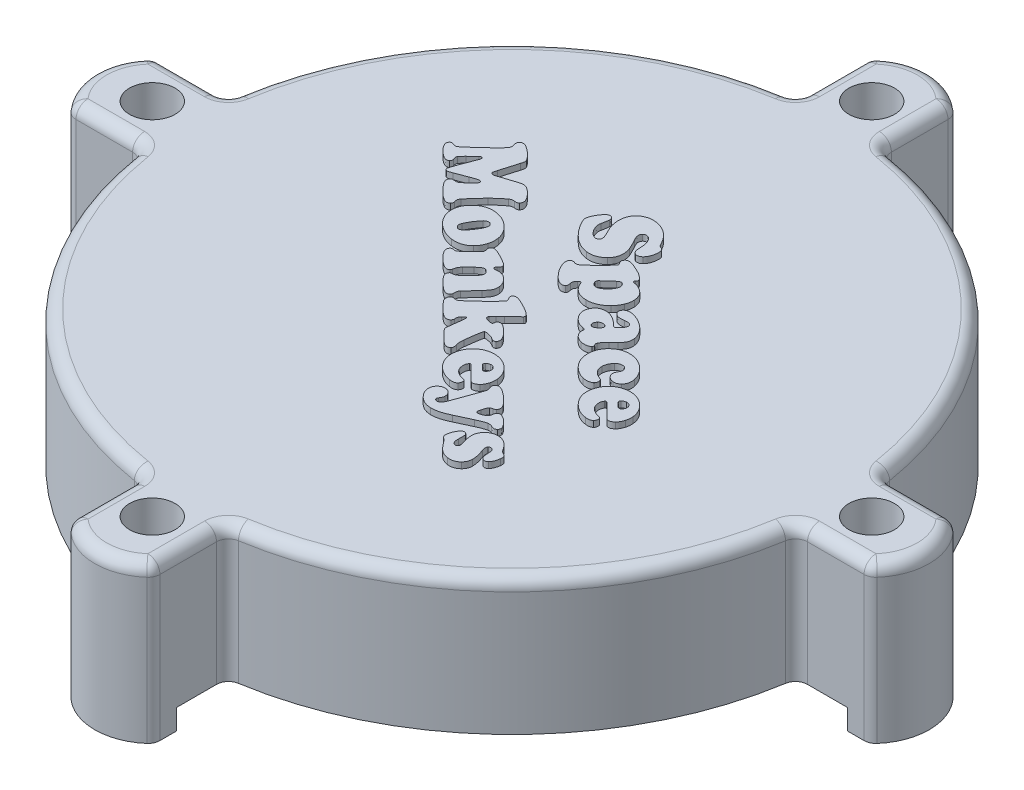
from build123d import *

# Parameters (mm, degrees)
SKETCH1_R              = 1.9
BOSS_EXTRUDE2_DEPTH    = 13
SKETCH2_R              = 1.9
CUT_EXTRUDE1_DEPTH     = 1.7
SKETCH3_R              = 25.75
CUT_EXTRUDE2_DEPTH     = 10
FILLET1_R              = 1
BOSS_EXTRUDE3_DEPTH    = 0.5
BOSS_EXTRUDE3_2_DEPTH  = 0.5
BOSS_EXTRUDE3_3_DEPTH  = 0.5
BOSS_EXTRUDE3_4_DEPTH  = 0.5
BOSS_EXTRUDE3_5_DEPTH  = 0.5
BOSS_EXTRUDE3_6_DEPTH  = 0.5
BOSS_EXTRUDE3_7_DEPTH  = 0.5
BOSS_EXTRUDE3_8_DEPTH  = 0.5
BOSS_EXTRUDE3_9_DEPTH  = 0.5
BOSS_EXTRUDE3_10_DEPTH = 0.5
BOSS_EXTRUDE3_11_DEPTH = 0.5
BOSS_EXTRUDE3_12_DEPTH = 0.5


with BuildPart() as part:
    # Sketch1 → Boss-Extrude2 (new body)
    with BuildSketch(Plane(origin=(0, 0, 0), x_dir=(1, 0, 0), z_dir=(0, 1, 0))):
        with BuildLine():
            ThreePointArc((33.284813541, -3.5), (34.8, 0), (33.284813541, 3.5))
            Line((33.284813541, 3.5), (27.276363394, 3.5))
            ThreePointArc((27.276363394, 3.5), (19.445436483, 19.445436483), (3.5, 27.276363394))
            Line((3.5, 27.276363394), (3.5, 33.284813541))
            ThreePointArc((3.5, 33.284813541), (0, 34.8), (-3.5, 33.284813541))
            Line((-3.5, 33.284813541), (-3.5, 27.276363394))
            ThreePointArc((-3.5, 27.276363394), (-19.445436483, 19.445436483), (-27.276363394, 3.5))
            Line((-27.276363394, 3.5), (-33.284813541, 3.5))
            ThreePointArc((-33.284813541, 3.5), (-34.8, 0), (-33.284813541, -3.5))
            Line((-33.284813541, -3.5), (-27.276363394, -3.5))
            ThreePointArc((-27.276363394, -3.5), (-19.445436483, -19.445436483), (-3.5, -27.276363394))
            Line((-3.5, -27.276363394), (-3.5, -33.284813541))
            ThreePointArc((-3.5, -33.284813541), (0, -34.8), (3.5, -33.284813541))
            Line((3.5, -33.284813541), (3.5, -27.276363394))
            ThreePointArc((3.5, -27.276363394), (19.445436483, -19.445436483), (27.276363394, -3.5))
            Line((27.276363394, -3.5), (33.284813541, -3.5))
        make_face()
        with Locations(Location((30, 0, 0), (0, 0, 90))):
            Circle(SKETCH1_R, mode=Mode.SUBTRACT)
        with Locations(Location((0, 30, 0), (0, 0, 90))):
            Circle(SKETCH1_R, mode=Mode.SUBTRACT)
        with Locations(Location((0, -30, 0), (0, 0, 90))):
            Circle(SKETCH1_R, mode=Mode.SUBTRACT)
        with Locations(Location((-30, 0, 0), (0, 0, 90))):
            Circle(SKETCH1_R, mode=Mode.SUBTRACT)
    extrude(amount=BOSS_EXTRUDE2_DEPTH)

    # Sketch2 → Cut-Extrude1 (cut)
    with BuildSketch(Plane.XZ):
        with BuildLine():
            Line((-1.913356517, 32.627083333), (-16.189939756, 22.229166667))
            ThreePointArc((-16.189939756, 22.229166667), (-19.445436483, 19.445436483), (-22.229166667, 16.189939756))
            Line((-22.229166667, 16.189939756), (-32.627083333, 1.913356517))
            ThreePointArc((-32.627083333, 1.913356517), (-33.25, 0), (-32.627083333, -1.913356517))
            Line((-32.627083333, -1.913356517), (-22.229166667, -16.189939756))
            ThreePointArc((-22.229166667, -16.189939756), (-19.445436483, -19.445436483), (-16.189939756, -22.229166667))
            Line((-16.189939756, -22.229166667), (-1.913356517, -32.627083333))
            ThreePointArc((-1.913356517, -32.627083333), (0, -33.25), (1.913356517, -32.627083333))
            Line((1.913356517, -32.627083333), (16.189939756, -22.229166667))
            ThreePointArc((16.189939756, -22.229166667), (19.445436483, -19.445436483), (22.229166667, -16.189939756))
            Line((22.229166667, -16.189939756), (32.627083333, -1.913356517))
            ThreePointArc((32.627083333, -1.913356517), (33.25, 0), (32.627083333, 1.913356517))
            Line((32.627083333, 1.913356517), (22.229166667, 16.189939756))
            ThreePointArc((22.229166667, 16.189939756), (19.445436483, 19.445436483), (16.189939756, 22.229166667))
            Line((16.189939756, 22.229166667), (1.913356517, 32.627083333))
            ThreePointArc((1.913356517, 32.627083333), (0, 33.25), (-1.913356517, 32.627083333))
        make_face()
        with Locations(Location((0, 30, 0), (0, 0, 270))):
            Circle(SKETCH2_R, mode=Mode.SUBTRACT)
        with Locations(Location((30, 0, 0), (0, 0, 270))):
            Circle(SKETCH2_R, mode=Mode.SUBTRACT)
        with Locations(Location((0, -30, 0), (0, 0, 270))):
            Circle(SKETCH2_R, mode=Mode.SUBTRACT)
        with Locations(Location((-30, 0, 0), (0, 0, 270))):
            Circle(SKETCH2_R, mode=Mode.SUBTRACT)
    extrude(amount=-CUT_EXTRUDE1_DEPTH, mode=Mode.SUBTRACT)

    # Sketch3 → Cut-Extrude2 (cut)
    with BuildSketch(Plane.XZ.offset(-1.7)):
        with Locations(Location((0, 0, 0), (0, 0, 270))):
            Circle(SKETCH3_R)
    extrude(amount=-CUT_EXTRUDE2_DEPTH, mode=Mode.SUBTRACT)

    # Fillet1
    fillet1_edges = [part.edges().sort_by_distance(p)[0] for p in [
        (-34.8, 13, 0),
        (-30.280588468, 13, 3.5),
        (-19.445436483, 13, 19.445436483),
        (-3.5, 13, 30.280588468),
        (0, 13, 34.8),
        (-33.284813541, 6.5, -3.5),
        (-27.276363394, 7.35, -3.5),
        (-3.5, 7.35, -27.276363394),
        (-3.5, 6.5, -33.284813541),
        (3.5, 6.5, -33.284813541),
        (3.5, 7.35, -27.276363394),
        (27.276363394, 7.35, -3.5),
        (33.284813541, 6.5, -3.5),
        (33.284813541, 6.5, 3.5),
        (27.276363394, 7.35, 3.5),
        (3.5, 7.35, 27.276363394),
        (3.5, 6.5, 33.284813541),
        (-3.5, 6.5, 33.284813541),
        (-3.5, 7.35, 27.276363394),
        (-27.276363394, 7.35, 3.5),
        (-33.284813541, 6.5, 3.5),
        (3.5, 13, 30.280588468),
        (19.445436483, 13, 19.445436483),
        (30.280588468, 13, 3.5),
        (34.8, 13, 0),
        (30.280588468, 13, -3.5),
        (19.445436483, 13, -19.445436483),
        (3.5, 13, -30.280588468),
        (0, 13, -34.8),
        (-3.5, 13, -30.280588468),
        (-19.445436483, 13, -19.445436483),
        (-30.280588468, 13, -3.5),
    ]]
    fillet(fillet1_edges, radius=FILLET1_R)


with BuildPart() as body_2:
    # Sketch4 → Boss-Extrude3 (new body)
    with BuildSketch(Plane(origin=(0, 13, 0), x_dir=(1, 0, 0), z_dir=(0, 1, 0))):
        with BuildLine():
            add(Edge.make_bspline(
                [(1.523760873, 11.117890674), (1.545918901, 11.095323631), (1.591890758, 11.048503181), (1.656869899, 10.969149981), (1.724080217, 10.882421297), (1.792192942, 10.786127955), (1.861510863, 10.681390135), (1.931001882, 10.566411024), (2.002988899, 10.443707372), (2.049108392, 10.357566575), (2.072747359, 10.313414322)],
                knots=[0, 0, 0, 0, 0.776363905, 1.610743038, 2.516591411, 3.471065594, 4.506618289, 5.600541239, 6.770135493, 8, 8, 8, 8], degree=3))
            add(Edge.make_bspline(
                [(2.072747359, 10.313414322), (2.08331332, 10.294274574), (2.102008649, 10.26040885), (2.127234415, 10.231129217), (2.138203441, 10.218397431)],
                knots=[0, 0, 0, 0, 1.13033158, 2, 2, 2, 2], degree=3))
            add(Edge.make_bspline(
                [(2.138203441, 10.218397431), (2.145521487, 10.213011189), (2.165046164, 10.198640603), (2.204993938, 10.175743277), (2.263021147, 10.146718331), (2.308113378, 10.125712447), (2.333515941, 10.113878849)],
                knots=[0, 0, 0, 0, 0.491106175, 1.310279855, 2.484754827, 4, 4, 4, 4], degree=3))
            add(Edge.make_bspline(
                [(2.333515941, 10.113878849), (2.351620454, 10.104396023), (2.388173031, 10.085250426), (2.418503686, 10.05726718), (2.433811549, 10.043144052)],
                knots=[0, 0, 0, 0, 0.990601226, 2, 2, 2, 2], degree=3))
            add(Edge.make_bspline(
                [(2.433811549, 10.043144052), (2.447056042, 10.028091893), (2.474171537, 9.997275559), (2.505067639, 9.940933658), (2.526165635, 9.875605721), (2.543060289, 9.802205719), (2.547527572, 9.719445861), (2.548260123, 9.62807178), (2.538864615, 9.527916289), (2.523293704, 9.421524534), (2.502026294, 9.314214775), (2.473946591, 9.211189167), (2.443029766, 9.114196961), (2.406003308, 9.023622433), (2.362797586, 8.940477037), (2.314464963, 8.864055516), (2.263785507, 8.792153693), (2.223570081, 8.750447896), (2.203659522, 8.729799458)],
                knots=[0, 0, 0, 0, 0.674437677, 1.380778436, 2.146123324, 2.983811306, 3.911883709, 4.932129, 6.063133153, 7.297944362, 8.556630592, 9.747993567, 10.89598025, 11.986502428, 13.042404317, 14.049669124, 15.034395927, 16, 16, 16, 16], degree=3))
            add(Edge.make_bspline(
                [(2.203659522, 8.729799458), (2.180047166, 8.708210058), (2.134266079, 8.666351204), (2.055535997, 8.618318867), (1.970785272, 8.589194508), (1.883733944, 8.573959819), (1.797455387, 8.575615423), (1.71687915, 8.594793924), (1.643035328, 8.630319527), (1.602543562, 8.666097438), (1.581826751, 8.684402498)],
                knots=[0, 0, 0, 0, 1.106985347, 2.146291207, 3.168286113, 4.194636131, 5.194794005, 6.135269646, 7.045947597, 8, 8, 8, 8], degree=3))
            add(Edge.make_bspline(
                [(1.581826751, 8.684402498), (1.566317828, 8.700960494), (1.536652964, 8.732631984), (1.500006234, 8.783352534), (1.474690907, 8.834998372), (1.458692087, 8.879558107), (1.452468065, 8.920823817), (1.447229024, 8.960936838), (1.441652817, 9.010881924), (1.438435593, 9.070492591), (1.432155333, 9.139702579), (1.428709098, 9.218258032), (1.424209759, 9.306571903), (1.421650317, 9.368521219), (1.420298035, 9.40125216)],
                knots=[0, 0, 0, 0, 1.079807866, 2.065414393, 2.964625712, 3.812410274, 4.305498313, 4.94770736, 5.739674396, 6.697104579, 7.789449984, 9.047922024, 10.440268638, 12, 12, 12, 12], degree=3))
            add(Edge.make_bspline(
                [(1.420298035, 9.40125216), (1.417661094, 9.448094951), (1.412531305, 9.539220838), (1.396278809, 9.671413064), (1.36956288, 9.794540744), (1.33521044, 9.908861126), (1.291690014, 10.013724365), (1.240884992, 10.110036729), (1.181025011, 10.197334054), (1.133444506, 10.248157181), (1.109909522, 10.273296079)],
                knots=[0, 0, 0, 0, 1.187988079, 2.311059282, 3.368570828, 4.374979913, 5.329922233, 6.238931981, 7.128914094, 8, 8, 8, 8], degree=3))
            add(Edge.make_bspline(
                [(1.109909522, 10.273296079), (1.086915284, 10.2947559), (1.04270342, 10.336017483), (0.969639406, 10.384352047), (0.894198586, 10.415714578), (0.819057622, 10.431557526), (0.745389547, 10.434012053), (0.676083125, 10.416743606), (0.610430316, 10.386601802), (0.574925732, 10.35358783), (0.556700062, 10.336640674)],
                knots=[0, 0, 0, 0, 1.207103581, 2.320942285, 3.345435652, 4.326631733, 5.25969281, 6.148499901, 7.049564161, 8, 8, 8, 8], degree=3))
            add(Edge.make_bspline(
                [(0.556700062, 10.336640674), (0.540203947, 10.31762195), (0.507335773, 10.279727529), (0.475698991, 10.209674685), (0.458509342, 10.132083849), (0.458409846, 10.045669856), (0.474187172, 9.95163412), (0.504710085, 9.849039782), (0.550602699, 9.738300248), (0.589848968, 9.663470596), (0.610542968, 9.624013985)],
                knots=[0, 0, 0, 0, 0.785005441, 1.564107334, 2.377092263, 3.258967115, 4.252039299, 5.354296754, 6.604958301, 8, 8, 8, 8], degree=3))
            add(Edge.make_bspline(
                [(0.610542968, 9.624013985), (0.639872188, 9.570588543), (0.695869388, 9.468585314), (0.773850096, 9.322096929), (0.842455761, 9.189586779), (0.903167264, 9.072292298), (0.952290303, 8.967712767), (0.995190915, 8.879108027), (1.027176269, 8.803541643), (1.044236232, 8.757652592), (1.051843643, 8.73718966)],
                knots=[0, 0, 0, 0, 1.475554238, 2.817221416, 4.017620014, 5.088344025, 6.0143746, 6.814766309, 7.471478382, 8, 8, 8, 8], degree=3))
            add(Edge.make_bspline(
                [(1.051843643, 8.73718966), (1.065081106, 8.698296386), (1.091084915, 8.621894035), (1.119679257, 8.506524804), (1.143706479, 8.394356085), (1.159439951, 8.284657462), (1.168092846, 8.177813384), (1.169221127, 8.073738497), (1.163024705, 7.972442218), (1.149164617, 7.873638837), (1.128326916, 7.777512366), (1.099092061, 7.684330414), (1.06509269, 7.592921195), (1.020643496, 7.505506358), (0.971723507, 7.419185014), (0.912951178, 7.337419517), (0.848492526, 7.257335072), (0.80061167, 7.207426621), (0.776294657, 7.182079863)],
                knots=[0, 0, 0, 0, 1.176169008, 2.310478614, 3.401649622, 4.460740477, 5.48193503, 6.469754762, 7.439252556, 8.385738263, 9.324842696, 10.252628272, 11.181070609, 12.114151776, 13.058057912, 14.020034193, 14.994444572, 16, 16, 16, 16], degree=3))
            add(Edge.make_bspline(
                [(0.776294657, 7.182079863), (0.731424316, 7.139880931), (0.643189724, 7.056899489), (0.497758532, 6.951857066), (0.344030928, 6.867494021), (0.182945991, 6.803283512), (0.014584315, 6.756510227), (-0.161485421, 6.733621323), (-0.344898951, 6.727149484), (-0.468490775, 6.739654957), (-0.531771222, 6.746057904)],
                knots=[0, 0, 0, 0, 1.031915392, 2.029194154, 2.998271133, 3.964614157, 4.930741013, 5.919518716, 6.93476947, 8, 8, 8, 8], degree=3))
            add(Edge.make_bspline(
                [(-0.531771222, 6.746057904), (-0.597850605, 6.75634818), (-0.730373967, 6.776985511), (-0.926119726, 6.832415549), (-1.119356618, 6.906329412), (-1.310171462, 7.000167811), (-1.498869538, 7.112543812), (-1.684477884, 7.245097923), (-1.868020968, 7.396771405), (-1.984831276, 7.508931714), (-2.044651289, 7.566370404)],
                knots=[0, 0, 0, 0, 0.915015794, 1.835080217, 2.779208859, 3.744677329, 4.742969419, 5.783189879, 6.864743945, 8, 8, 8, 8], degree=3))
            add(Edge.make_bspline(
                [(-2.044651289, 7.566370404), (-2.098122666, 7.621701635), (-2.206280382, 7.733621318), (-2.35838579, 7.915929872), (-2.50611541, 8.111030061), (-2.62293858, 8.282724567), (-2.710914825, 8.422011551), (-2.770291237, 8.522234198), (-2.821693958, 8.61732736), (-2.867698721, 8.706444456), (-2.906917401, 8.789947875), (-2.937726091, 8.869124364), (-2.962245085, 8.942396466), (-2.974322978, 8.990140146), (-2.980039803, 9.012738647)],
                knots=[0, 0, 0, 0, 1.592998548, 3.222192744, 4.912944246, 6.659383119, 7.5207148, 8.324374899, 9.071172806, 9.758881832, 10.401229754, 10.980449289, 11.517416397, 12, 12, 12, 12], degree=3))
            add(Edge.make_bspline(
                [(-2.980039803, 9.012738647), (-2.982603945, 9.030300355), (-2.987968553, 9.067042339), (-2.987057512, 9.125514866), (-2.981160226, 9.188900965), (-2.96592189, 9.256934604), (-2.948286973, 9.330964113), (-2.918895462, 9.408957892), (-2.887385527, 9.493524437), (-2.833185882, 9.610571302), (-2.758790851, 9.755489977), (-2.656094089, 9.918092807), (-2.544126309, 10.0678562), (-2.460068383, 10.157200207), (-2.418384397, 10.201505539)],
                knots=[0, 0, 0, 0, 0.472733888, 0.989037068, 1.555086095, 2.168144186, 2.846634567, 3.582926894, 4.388324844, 5.253793958, 7.021455969, 8.72997592, 10.378408272, 12, 12, 12, 12], degree=3))
            add(Edge.make_bspline(
                [(-2.418384397, 10.201505539), (-2.398489487, 10.220447419), (-2.361310272, 10.255845632), (-2.300661453, 10.296673199), (-2.241942557, 10.326166398), (-2.201166876, 10.333279368), (-2.181897911, 10.336640674)],
                knots=[0, 0, 0, 0, 1.186412149, 2.217143625, 3.15749301, 4, 4, 4, 4], degree=3))
            add(Edge.make_bspline(
                [(-2.181897911, 10.336640674), (-2.158967539, 10.33851775), (-2.11480735, 10.342132695), (-2.050582831, 10.328208436), (-1.991343728, 10.302098644), (-1.959519113, 10.273228914), (-1.943299938, 10.258515674)],
                knots=[0, 0, 0, 0, 1.054873829, 2.031516466, 2.996777197, 4, 4, 4, 4], degree=3))
            add(Edge.make_bspline(
                [(-1.943299938, 10.258515674), (-1.928510277, 10.241601627), (-1.898254922, 10.207000394), (-1.871823355, 10.13943715), (-1.856541303, 10.062166464), (-1.858043165, 10.006983627), (-1.858840478, 9.977687971)],
                knots=[0, 0, 0, 0, 0.886637297, 1.813802645, 2.839383954, 4, 4, 4, 4], degree=3))
            add(Edge.make_bspline(
                [(-1.858840478, 9.977687971), (-1.859434464, 9.966769291), (-1.860856197, 9.940634934), (-1.866595673, 9.895591428), (-1.875067231, 9.838578056), (-1.886919932, 9.7696299), (-1.90174285, 9.6883433), (-1.919639708, 9.594720051), (-1.940785019, 9.489148297), (-1.956265568, 9.41496547), (-1.964414803, 9.375914322)],
                knots=[0, 0, 0, 0, 0.429157813, 1.027208729, 1.781365263, 2.692113266, 3.773314202, 5.025085373, 6.433952501, 8, 8, 8, 8], degree=3))
            add(Edge.make_bspline(
                [(-1.964414803, 9.375914322), (-1.970295307, 9.335884143), (-1.982382499, 9.253603356), (-1.975439086, 9.123807473), (-1.949168878, 8.987185746), (-1.90533194, 8.845854261), (-1.844476027, 8.705859558), (-1.769700138, 8.572451458), (-1.680662302, 8.448829531), (-1.611568244, 8.375067999), (-1.576957032, 8.338118714)],
                knots=[0, 0, 0, 0, 0.844438241, 1.735716475, 2.701403064, 3.748958901, 4.823569354, 5.887974974, 6.942025585, 8, 8, 8, 8], degree=3))
            add(Edge.make_bspline(
                [(-1.576957032, 8.338118714), (-1.547010041, 8.309529716), (-1.489483293, 8.254611609), (-1.396098669, 8.188177896), (-1.303548902, 8.13715091), (-1.212130983, 8.103947025), (-1.124459105, 8.088820279), (-1.044465465, 8.094948566), (-0.972109729, 8.119033914), (-0.934923392, 8.150916728), (-0.916061762, 8.167088309)],
                knots=[0, 0, 0, 0, 1.318096519, 2.532000806, 3.641112771, 4.677029602, 5.619333962, 6.452065434, 7.214857631, 8, 8, 8, 8], degree=3))
            add(Edge.make_bspline(
                [(-0.916061762, 8.167088309), (-0.900509959, 8.184292844), (-0.869635028, 8.218448938), (-0.842932908, 8.283627229), (-0.828284427, 8.354664285), (-0.832471852, 8.434564259), (-0.848522397, 8.524086949), (-0.88201227, 8.625222262), (-0.929624692, 8.739222463), (-0.970331147, 8.817723208), (-0.992075276, 8.859655876)],
                knots=[0, 0, 0, 0, 0.741155056, 1.471412102, 2.233306948, 3.060432687, 4.026886846, 5.155255471, 6.480425502, 8, 8, 8, 8], degree=3))
            add(Edge.make_bspline(
                [(-0.992075276, 8.859655876), (-1.030188536, 8.934036507), (-1.101830427, 9.073850551), (-1.195821155, 9.27398646), (-1.273150426, 9.449635748), (-1.330956135, 9.607361934), (-1.375033305, 9.754689387), (-1.407233495, 9.900865258), (-1.432417917, 10.049857766), (-1.440781123, 10.150743968), (-1.444989127, 10.201505539)],
                knots=[0, 0, 0, 0, 1.404740517, 2.640505349, 3.716277519, 4.629511319, 5.462406036, 6.29907332, 7.144167307, 8, 8, 8, 8], degree=3))
            add(Edge.make_bspline(
                [(-1.444989127, 10.201505539), (-1.447131744, 10.262043785), (-1.4513216, 10.380425444), (-1.439203612, 10.55356059), (-1.413845557, 10.718063302), (-1.369503998, 10.872198785), (-1.313360963, 11.018696308), (-1.238194349, 11.154016752), (-1.14977269, 11.281196626), (-1.079262038, 11.356586572), (-1.043806695, 11.394495404)],
                knots=[0, 0, 0, 0, 1.118696279, 2.187594264, 3.202175684, 4.188349095, 5.145978361, 6.094712048, 7.041951298, 8, 8, 8, 8], degree=3))
            add(Edge.make_bspline(
                [(-1.043806695, 11.394495404), (-1.005962451, 11.430037572), (-0.930280068, 11.501116176), (-0.800670376, 11.589090771), (-0.661512936, 11.665391179), (-0.510902592, 11.724625702), (-0.353118058, 11.76877785), (-0.190806473, 11.796886968), (-0.024566661, 11.805386789), (0.086575831, 11.797539522), (0.142848711, 11.793566349)],
                knots=[0, 0, 0, 0, 0.962159717, 1.924164264, 2.897299794, 3.902686475, 4.920008574, 5.93357124, 6.953740406, 8, 8, 8, 8], degree=3))
            add(Edge.make_bspline(
                [(0.142848711, 11.793566349), (0.206741119, 11.786351216), (0.333792474, 11.772003777), (0.520333986, 11.728709165), (0.701671614, 11.669574694), (0.877619127, 11.593079491), (1.048241616, 11.499719387), (1.213275544, 11.389185263), (1.373634419, 11.262451146), (1.473156206, 11.166619158), (1.523760873, 11.117890674)],
                knots=[0, 0, 0, 0, 0.982081462, 1.952888987, 2.920726738, 3.893974903, 4.880875848, 5.889337238, 6.926773832, 8, 8, 8, 8], degree=3))
        make_face()
    extrude(amount=BOSS_EXTRUDE3_DEPTH)


with BuildPart() as body_3:
    # Sketch4 → Boss-Extrude3 2 (new body)
    with BuildSketch(Plane(origin=(0, 13, 0), x_dir=(1, 0, 0), z_dir=(0, 1, 0))):
        with BuildLine():
            add(Edge.make_bspline(
                [(3.569620649, 7.05767279), (3.592569162, 7.034478461), (3.633815571, 6.992790237), (3.683297199, 6.932255809), (3.718307212, 6.884658581), (3.735521953, 6.842896489), (3.734103836, 6.802501987), (3.714619114, 6.762510995), (3.682875325, 6.717365596), (3.654907041, 6.687780398), (3.639299703, 6.671270763)],
                knots=[0, 0, 0, 0, 1.650839537, 2.967129221, 3.955451214, 4.637402769, 5.207825265, 5.942439218, 6.851804931, 8, 8, 8, 8], degree=3))
            add(Edge.make_bspline(
                [(3.639299703, 6.671270763), (3.626213662, 6.657125141), (3.603163371, 6.632208461), (3.581485995, 6.590161681), (3.58282807, 6.548058857), (3.598623298, 6.528187511), (3.606571662, 6.518187992)],
                knots=[0, 0, 0, 0, 1.310533141, 2.308426958, 3.148778482, 4, 4, 4, 4], degree=3))
            add(Edge.make_bspline(
                [(3.606571662, 6.518187992), (3.615256943, 6.513351552), (3.639830229, 6.499667798), (3.693578283, 6.485081274), (3.772124855, 6.464659606), (3.834152262, 6.452348114), (3.86945173, 6.445341709)],
                knots=[0, 0, 0, 0, 0.43472072, 1.229956417, 2.4235829, 4, 4, 4, 4], degree=3))
            add(Edge.make_bspline(
                [(3.86945173, 6.445341709), (3.900624459, 6.438672029), (3.965034329, 6.424890972), (4.061335363, 6.389032468), (4.162908017, 6.346297132), (4.266191357, 6.292929123), (4.366906814, 6.234355733), (4.461222441, 6.173188686), (4.544282901, 6.108147413), (4.594007708, 6.061407774), (4.617973689, 6.03888056)],
                knots=[0, 0, 0, 0, 0.886752681, 1.832230526, 2.855397807, 3.955658693, 5.066866853, 6.099892499, 7.084200736, 8, 8, 8, 8], degree=3))
            add(Edge.make_bspline(
                [(4.617973689, 6.03888056), (4.643442666, 6.011852057), (4.693881226, 5.958325024), (4.760393896, 5.871417421), (4.818134998, 5.780123031), (4.865612676, 5.683282039), (4.904805951, 5.581523355), (4.935379944, 5.474892904), (4.956951112, 5.36358914), (4.963204005, 5.287631306), (4.96636896, 5.249184614)],
                knots=[0, 0, 0, 0, 1.008903612, 1.998024676, 2.969364331, 3.940421359, 4.924534652, 5.929667668, 6.952083984, 8, 8, 8, 8], degree=3))
            add(Edge.make_bspline(
                [(4.96636896, 5.249184614), (4.967871843, 5.189300365), (4.970887974, 5.069118866), (4.947993345, 4.888491892), (4.906577269, 4.707085835), (4.86156625, 4.589935347), (4.838624027, 4.530223465)],
                knots=[0, 0, 0, 0, 0.975093084, 1.956911027, 2.95863271, 4, 4, 4, 4], degree=3))
            add(Edge.make_bspline(
                [(4.838624027, 4.530223465), (4.81029794, 4.467999376), (4.754018064, 4.34436903), (4.6475247, 4.170047371), (4.525564925, 4.005300801), (4.431121446, 3.905714229), (4.383598689, 3.855603533)],
                knots=[0, 0, 0, 0, 1.001417339, 1.989672697, 2.988428882, 4, 4, 4, 4], degree=3))
            add(Edge.make_bspline(
                [(4.383598689, 3.855603533), (4.331061396, 3.805242264), (4.227726927, 3.706187771), (4.059112094, 3.578895069), (3.884852249, 3.470601336), (3.70351643, 3.384439633), (3.516628087, 3.315361874), (3.322754439, 3.26934119), (3.122366529, 3.243362094), (2.986926959, 3.24190172), (2.918227068, 3.241160965)],
                knots=[0, 0, 0, 0, 1.067395218, 2.09943662, 3.094292955, 4.073852875, 5.041175267, 6.013353525, 6.992300433, 8, 8, 8, 8], degree=3))
            add(Edge.make_bspline(
                [(2.918227068, 3.241160965), (2.86534779, 3.242894028), (2.761588562, 3.246294628), (2.610214394, 3.269733273), (2.465307587, 3.302730484), (2.327837741, 3.350643095), (2.197223072, 3.410929083), (2.074217578, 3.484293623), (1.958001418, 3.570106456), (1.887538952, 3.63632506), (1.851926392, 3.669792722)],
                knots=[0, 0, 0, 0, 1.075698706, 2.110726043, 3.111238516, 4.096384395, 5.067188768, 6.033731434, 7.006224715, 8, 8, 8, 8], degree=3))
            add(Edge.make_bspline(
                [(1.851926392, 3.669792722), (1.817167874, 3.70700025), (1.746839618, 3.782283683), (1.657832136, 3.912079493), (1.577334328, 4.054107842), (1.534829998, 4.156677477), (1.513032811, 4.20927752)],
                knots=[0, 0, 0, 0, 0.951314939, 1.924832391, 2.935806838, 4, 4, 4, 4], degree=3))
            add(Edge.make_bspline(
                [(1.513032811, 4.20927752), (1.505662544, 4.228562221), (1.492769023, 4.262298813), (1.46999952, 4.290221544), (1.460245649, 4.302182925)],
                knots=[0, 0, 0, 0, 1.143251332, 2, 2, 2, 2], degree=3))
            add(Edge.make_bspline(
                [(1.460245649, 4.302182925), (1.446753212, 4.311899306), (1.418730298, 4.332079598), (1.358288401, 4.322960187), (1.29717777, 4.284707068), (1.257195942, 4.247475143), (1.234316595, 4.226169411)],
                knots=[0, 0, 0, 0, 0.731370279, 1.519008487, 2.580268399, 4, 4, 4, 4], degree=3))
            add(Edge.make_bspline(
                [(1.234316595, 4.226169411), (1.204870763, 4.193937309), (1.149417416, 4.133236768), (1.094600625, 4.027134444), (1.068251034, 3.917029831), (1.07761203, 3.844391353), (1.082289568, 3.808095087)],
                knots=[0, 0, 0, 0, 1.125048948, 2.118728691, 3.059959322, 4, 4, 4, 4], degree=3))
            add(Edge.make_bspline(
                [(1.082289568, 3.808095087), (1.087998953, 3.777153185), (1.098294542, 3.721356442), (1.110907631, 3.647144687), (1.115415438, 3.591823129), (1.119129124, 3.551902639), (1.1114508, 3.520458215), (1.096619006, 3.491017333), (1.074510486, 3.459755785), (1.055479561, 3.439745918), (1.045338554, 3.429083263)],
                knots=[0, 0, 0, 0, 1.870271248, 3.37261254, 4.46496143, 5.176217987, 5.734173536, 6.360784186, 7.126511243, 8, 8, 8, 8], degree=3))
            add(Edge.make_bspline(
                [(1.045338554, 3.429083263), (1.03268106, 3.417351088), (1.007818464, 3.394306059), (0.964528769, 3.368103944), (0.919128977, 3.347175858), (0.869590791, 3.335923583), (0.8173396, 3.331726896), (0.761968373, 3.335194383), (0.703578827, 3.346068382), (0.619507446, 3.371027124), (0.508649214, 3.421645584), (0.374377016, 3.509387858), (0.23039736, 3.620351169), (0.138585201, 3.709916681), (0.089890919, 3.757419411)],
                knots=[0, 0, 0, 0, 0.555817535, 1.091769544, 1.625911917, 2.163307245, 2.721905044, 3.313719804, 3.948883848, 4.635613391, 6.141131728, 7.862227057, 9.805455372, 12, 12, 12, 12], degree=3))
            add(Edge.make_bspline(
                [(0.089890919, 3.757419411), (0.04566206, 3.802625446), (-0.041531974, 3.891745909), (-0.160327382, 4.032957807), (-0.2696073, 4.175127026), (-0.367183208, 4.320470975), (-0.453686144, 4.468323087), (-0.530252578, 4.618508937), (-0.595204505, 4.771549802), (-0.629116613, 4.87623655), (-0.645962121, 4.928238668)],
                knots=[0, 0, 0, 0, 1.086314387, 2.141591135, 3.168349205, 4.166194975, 5.147246053, 6.109938417, 7.061130402, 8, 8, 8, 8], degree=3))
            add(Edge.make_bspline(
                [(-0.645962121, 4.928238668), (-0.653036715, 4.953827222), (-0.666679788, 5.003173734), (-0.680092841, 5.075880917), (-0.683034352, 5.144007776), (-0.679025787, 5.207079176), (-0.667897762, 5.265649116), (-0.647585059, 5.319223926), (-0.618685095, 5.367967461), (-0.593345827, 5.395637011), (-0.58050604, 5.409657587)],
                knots=[0, 0, 0, 0, 1.245172767, 2.40126634, 3.458887329, 4.435047979, 5.360924007, 6.243866482, 7.110140819, 8, 8, 8, 8], degree=3))
            add(Edge.make_bspline(
                [(-0.58050604, 5.409657587), (-0.568585388, 5.421417427), (-0.54613736, 5.443562624), (-0.508253117, 5.467489957), (-0.472590031, 5.485871027), (-0.434791284, 5.493178762), (-0.393784283, 5.494140282), (-0.346271234, 5.487006254), (-0.291179172, 5.473048048), (-0.252761232, 5.459285162), (-0.23211077, 5.451887317)],
                knots=[0, 0, 0, 0, 1.057014516, 1.990485921, 2.828022092, 3.579917366, 4.404903231, 5.416774396, 6.611461118, 8, 8, 8, 8], degree=3))
            add(Edge.make_bspline(
                [(-0.23211077, 5.451887317), (-0.200723852, 5.442785699), (-0.13910305, 5.42491682), (-0.041006371, 5.427818872), (0.055154903, 5.45712409), (0.135897049, 5.502190311), (0.20744165, 5.558328581), (0.282021923, 5.61844963), (0.372839674, 5.699633178), (0.484442879, 5.796900721), (0.611194638, 5.915944284), (0.75741928, 6.052282769), (0.921939609, 6.206931566), (1.036665869, 6.317465721), (1.097069973, 6.375662655)],
                knots=[0, 0, 0, 0, 0.695438739, 1.365329754, 2.063044628, 2.827560393, 3.327220374, 4.006512651, 4.875800896, 5.931282945, 7.171989813, 8.593491464, 10.206451644, 12, 12, 12, 12], degree=3))
            add(Edge.make_bspline(
                [(1.097069973, 6.375662655), (1.144410657, 6.425463497), (1.233620798, 6.519309633), (1.356282162, 6.653807938), (1.46423519, 6.76980853), (1.552898964, 6.870746983), (1.625855902, 6.954237004), (1.680126337, 7.021908151), (1.719846096, 7.071354405), (1.7367238, 7.101161019), (1.743184838, 7.112571438)],
                knots=[0, 0, 0, 0, 1.680610361, 3.166990336, 4.452433147, 5.556142455, 6.453375905, 7.163190699, 7.679656824, 8, 8, 8, 8], degree=3))
            add(Edge.make_bspline(
                [(1.743184838, 7.112571438), (1.747576984, 7.123300577), (1.755705317, 7.143156476), (1.749711565, 7.172346249), (1.734036875, 7.197030334), (1.715451692, 7.229177409), (1.686756559, 7.273085837), (1.664079891, 7.306177623), (1.651335176, 7.32477583)],
                knots=[0, 0, 0, 0, 0.844598331, 1.563057401, 2.101822293, 3.017214199, 4.32361819, 6, 6, 6, 6], degree=3))
            add(Edge.make_bspline(
                [(1.651335176, 7.32477583), (1.641651906, 7.340689958), (1.622574064, 7.37204375), (1.603551882, 7.42311872), (1.593584821, 7.476026848), (1.594232109, 7.52952172), (1.601693323, 7.582838491), (1.621845023, 7.632785521), (1.649200371, 7.680493673), (1.67433044, 7.707745912), (1.687230446, 7.72173529)],
                knots=[0, 0, 0, 0, 1.028746508, 2.026821898, 2.99677683, 3.989711884, 4.975559243, 5.955428793, 6.950461264, 8, 8, 8, 8], degree=3))
            add(Edge.make_bspline(
                [(1.687230446, 7.72173529), (1.704264953, 7.737255711), (1.737997055, 7.767989589), (1.798260248, 7.800902279), (1.864004461, 7.821166117), (1.935826826, 7.829207783), (2.015720589, 7.826588494), (2.105199912, 7.812142881), (2.205085388, 7.786350282), (2.273701028, 7.762070939), (2.31011896, 7.749184614)],
                knots=[0, 0, 0, 0, 0.833905749, 1.651318394, 2.467233305, 3.316256401, 4.261619507, 5.359735187, 6.598672489, 8, 8, 8, 8], degree=3))
            add(Edge.make_bspline(
                [(2.31011896, 7.749184614), (2.382073365, 7.721442085), (2.521118331, 7.667832317), (2.719932701, 7.583487089), (2.90210149, 7.498057034), (3.067717071, 7.411292594), (3.218134838, 7.32591758), (3.350307493, 7.237416915), (3.467915355, 7.15070189), (3.536670721, 7.087811852), (3.569620649, 7.05767279)],
                knots=[0, 0, 0, 0, 1.28020491, 2.473872852, 3.584608253, 4.619427563, 5.577428093, 6.454051031, 7.259128267, 8, 8, 8, 8], degree=3))
        make_face()
        with BuildLine():
            Line((2.869662879, 5.861515695), (2.143311527, 5.209066371))
            add(Edge.make_bspline(
                [(2.143311527, 5.209066371), (2.12844764, 5.195783667), (2.099104786, 5.169562234), (2.070737944, 5.142288073), (2.056740581, 5.128829884)],
                knots=[0, 0, 0, 0, 1.01311806, 2, 2, 2, 2], degree=3))
            add(Edge.make_bspline(
                [(2.056740581, 5.128829884), (2.045018477, 5.115654943), (2.02223521, 5.090047917), (2.001842073, 5.04221127), (1.99315205, 4.990437441), (1.998290254, 4.934985197), (2.014282195, 4.87771466), (2.042622396, 4.820167221), (2.082164871, 4.762614762), (2.115345702, 4.727216071), (2.132754095, 4.708644074)],
                knots=[0, 0, 0, 0, 0.883066422, 1.716341935, 2.578890053, 3.503326234, 4.496731484, 5.559064422, 6.719358019, 8, 8, 8, 8], degree=3))
            add(Edge.make_bspline(
                [(2.132754095, 4.708644074), (2.161520073, 4.683115991), (2.217012031, 4.633870201), (2.317824672, 4.587509264), (2.426229414, 4.57283557), (2.540348878, 4.588135982), (2.659713661, 4.63323557), (2.785467737, 4.705526392), (2.917954183, 4.806081398), (3.002852912, 4.887845385), (3.048083487, 4.931405898)],
                knots=[0, 0, 0, 0, 0.866443329, 1.671441089, 2.467296473, 3.309451341, 4.248600404, 5.335623397, 6.580528984, 8, 8, 8, 8], degree=3))
            add(Edge.make_bspline(
                [(3.048083487, 4.931405898), (3.07731838, 4.96131845), (3.133612976, 5.018917942), (3.208835201, 5.107750769), (3.272432638, 5.194702399), (3.325739103, 5.278464182), (3.366695175, 5.361017191), (3.39590019, 5.441065089), (3.416964061, 5.518747745), (3.419518122, 5.570356921), (3.420760852, 5.595468398)],
                knots=[0, 0, 0, 0, 1.287998765, 2.480165333, 3.581507066, 4.604077193, 5.534799698, 6.412709743, 7.227672178, 8, 8, 8, 8], degree=3))
            add(Edge.make_bspline(
                [(3.420760852, 5.595468398), (3.419813578, 5.624816837), (3.417957782, 5.682313102), (3.395368202, 5.765043505), (3.355242786, 5.84024724), (3.317543952, 5.882282099), (3.298294635, 5.903745425)],
                knots=[0, 0, 0, 0, 1.03050889, 2.018860719, 2.988414917, 4, 4, 4, 4], degree=3))
            add(Edge.make_bspline(
                [(3.298294635, 5.903745425), (3.283660686, 5.917073651), (3.255365006, 5.942844632), (3.206240829, 5.969484853), (3.154633919, 5.984238614), (3.100574292, 5.98489276), (3.044547283, 5.972550669), (2.986927115, 5.947293023), (2.927666265, 5.909680796), (2.889718835, 5.878169846), (2.869662879, 5.861515695)],
                knots=[0, 0, 0, 0, 0.977180344, 1.889440939, 2.739150144, 3.610557544, 4.536691108, 5.559416435, 6.710104056, 8, 8, 8, 8], degree=3))
        make_face(mode=Mode.SUBTRACT)
    extrude(amount=BOSS_EXTRUDE3_2_DEPTH)


with BuildPart() as body_4:
    # Sketch4 → Boss-Extrude3 3 (new body)
    with BuildSketch(Plane(origin=(0, 13, 0), x_dir=(1, 0, 0), z_dir=(0, 1, 0))):
        with BuildLine():
            add(Edge.make_bspline(
                [(7.227082693, 3.429771557), (7.262031669, 3.393243659), (7.330691272, 3.32148216), (7.42413933, 3.208341832), (7.505208563, 3.091721689), (7.577261446, 2.973222041), (7.635468519, 2.850667542), (7.685062129, 2.726544839), (7.722335392, 2.599207213), (7.738439675, 2.512491957), (7.746508368, 2.469045206)],
                knots=[0, 0, 0, 0, 1.092236112, 2.145770886, 3.166859099, 4.159341962, 5.138892422, 6.094929407, 7.045506745, 8, 8, 8, 8], degree=3))
            add(Edge.make_bspline(
                [(7.746508368, 2.469045206), (7.751860549, 2.424070304), (7.762251674, 2.33675267), (7.758783615, 2.208248782), (7.740372151, 2.087228492), (7.703242727, 1.971822386), (7.645696456, 1.857980901), (7.567417767, 1.740359769), (7.466335936, 1.617257395), (7.388507235, 1.536273331), (7.347437422, 1.493538449)],
                knots=[0, 0, 0, 0, 0.984705534, 1.911780894, 2.78820802, 3.640850426, 4.538311621, 5.555891665, 6.710256363, 8, 8, 8, 8], degree=3))
            Line((7.347437422, 1.493538449), (6.968425598, 1.125084057))
            add(Edge.make_bspline(
                [(6.968425598, 1.125084057), (6.937678646, 1.093890452), (6.879142681, 1.034504152), (6.797441059, 0.947586298), (6.72594897, 0.86771308), (6.663707441, 0.79488781), (6.613653089, 0.727731202), (6.572895424, 0.668050219), (6.541014402, 0.615774057), (6.527098559, 0.581208717), (6.520790463, 0.565540138)],
                knots=[0, 0, 0, 0, 1.458927184, 2.777501652, 3.972932827, 5.02955469, 5.967328057, 6.760633889, 7.438191371, 8, 8, 8, 8], degree=3))
            add(Edge.make_bspline(
                [(6.520790463, 0.565540138), (6.513759419, 0.541976505), (6.50191347, 0.502276344), (6.498417966, 0.450966297), (6.511961347, 0.416830168), (6.528661636, 0.387515417), (6.550363015, 0.350074675), (6.569406738, 0.324279831), (6.579912084, 0.310050273)],
                knots=[0, 0, 0, 0, 1.591191002, 2.680848897, 3.212270508, 3.933368881, 4.859956367, 6, 6, 6, 6], degree=3))
            add(Edge.make_bspline(
                [(6.579912084, 0.310050273), (6.589524795, 0.295139918), (6.607676312, 0.266984949), (6.610508863, 0.216032522), (6.592588122, 0.16682366), (6.568740353, 0.140026825), (6.55562999, 0.125295206)],
                knots=[0, 0, 0, 0, 1.018969934, 1.924103584, 2.85877139, 4, 4, 4, 4], degree=3))
            add(Edge.make_bspline(
                [(6.55562999, 0.125295206), (6.534173804, 0.105992212), (6.490035999, 0.066283769), (6.406882131, 0.024135105), (6.312763129, -0.010044247), (6.206677605, -0.031050868), (6.093814595, -0.04132321), (5.977058466, -0.040379873), (5.858508462, -0.026696456), (5.780216813, -0.008494073), (5.740596206, 0.000717503)],
                knots=[0, 0, 0, 0, 0.804297613, 1.654531263, 2.585738602, 3.601444197, 4.669351916, 5.752447657, 6.862594022, 8, 8, 8, 8], degree=3))
            add(Edge.make_bspline(
                [(5.740596206, 0.000717503), (5.692242879, 0.015251437), (5.597087996, 0.043852876), (5.464811511, 0.108536743), (5.342603577, 0.18670296), (5.272352664, 0.251906155), (5.237006679, 0.284712435)],
                knots=[0, 0, 0, 0, 1.034754065, 2.036300421, 3.011985841, 4, 4, 4, 4], degree=3))
            add(Edge.make_bspline(
                [(5.237006679, 0.284712435), (5.216241301, 0.306920988), (5.175760025, 0.350215675), (5.122133513, 0.419195159), (5.078644061, 0.491185304), (5.045055951, 0.565476591), (5.018767737, 0.641258118), (5.003171787, 0.719720115), (4.996666185, 0.800542673), (4.999225628, 0.854813152), (5.000520193, 0.882263111)],
                knots=[0, 0, 0, 0, 1.097714551, 2.139950747, 3.149116614, 4.127316329, 5.079832197, 6.039443883, 7.008352482, 8, 8, 8, 8], degree=3))
            add(Edge.make_bspline(
                [(5.000520193, 0.882263111), (5.002144268, 0.900209028), (5.005141201, 0.933324919), (5.001267557, 0.97901782), (4.990577659, 1.01724541), (4.975790214, 1.036029114), (4.968847895, 1.044847571)],
                knots=[0, 0, 0, 0, 1.26431024, 2.333052099, 3.217411608, 4, 4, 4, 4], degree=3))
            add(Edge.make_bspline(
                [(4.968847895, 1.044847571), (4.958554786, 1.052990613), (4.936009384, 1.070826638), (4.891933305, 1.091009178), (4.835960056, 1.104306709), (4.79469768, 1.110949672), (4.772479652, 1.114526625)],
                knots=[0, 0, 0, 0, 0.743090671, 1.627620658, 2.72257498, 4, 4, 4, 4], degree=3))
            add(Edge.make_bspline(
                [(4.772479652, 1.114526625), (4.736824713, 1.121043618), (4.665968411, 1.133994699), (4.56234723, 1.162498528), (4.462891985, 1.199624526), (4.367203772, 1.244689498), (4.274057728, 1.295807067), (4.185547078, 1.356549569), (4.100099828, 1.424257988), (4.04747739, 1.475129625), (4.020790463, 1.500928652)],
                knots=[0, 0, 0, 0, 1.011482187, 2.010097075, 2.995480826, 3.971169702, 4.960658422, 5.957919386, 6.964379881, 8, 8, 8, 8], degree=3))
            add(Edge.make_bspline(
                [(4.020790463, 1.500928652), (3.994422938, 1.528077688), (3.942997744, 1.581027083), (3.872994185, 1.663751774), (3.811303872, 1.747177003), (3.75889343, 1.831997324), (3.71262891, 1.915974403), (3.6769776, 2.00154977), (3.64763521, 2.086712801), (3.635231344, 2.144779634), (3.62910972, 2.173437098)],
                knots=[0, 0, 0, 0, 1.149353711, 2.24161121, 3.289278706, 4.297764509, 5.268666601, 6.197891333, 7.110613398, 8, 8, 8, 8], degree=3))
            add(Edge.make_bspline(
                [(3.62910972, 2.173437098), (3.624037101, 2.2110172), (3.613923468, 2.285943278), (3.61395155, 2.399872997), (3.629178839, 2.513622375), (3.657909752, 2.626093869), (3.697989835, 2.735514466), (3.753084289, 2.837080178), (3.816797594, 2.932527536), (3.868998892, 2.988081871), (3.895157017, 3.015920206)],
                knots=[0, 0, 0, 0, 0.99123009, 1.976284765, 2.969735431, 3.985667206, 5.008209644, 6.008970193, 7.002292885, 8, 8, 8, 8], degree=3))
            add(Edge.make_bspline(
                [(3.895157017, 3.015920206), (3.917197473, 3.036903132), (3.960626134, 3.07824803), (4.03393976, 3.130095743), (4.111073316, 3.174849104), (4.193511018, 3.21099371), (4.280956758, 3.236778766), (4.372235262, 3.256618216), (4.46859501, 3.265480449), (4.534222321, 3.265911629), (4.567665463, 3.266131354)],
                knots=[0, 0, 0, 0, 0.987736061, 1.946241673, 2.909375143, 3.882437739, 4.862797821, 5.867599023, 6.913345902, 8, 8, 8, 8], degree=3))
            add(Edge.make_bspline(
                [(4.567665463, 3.266131354), (4.621688778, 3.263398599), (4.730735379, 3.257882504), (4.893091879, 3.221820451), (5.055893978, 3.168821089), (5.219241558, 3.095520804), (5.381818822, 3.000085056), (5.545863103, 2.886866899), (5.710046585, 2.753442655), (5.814519937, 2.652840171), (5.868341138, 2.601013111)],
                knots=[0, 0, 0, 0, 0.866015549, 1.748061013, 2.656358053, 3.608605224, 4.612296665, 5.675111614, 6.802294701, 8, 8, 8, 8], degree=3))
            add(Edge.make_bspline(
                [(5.868341138, 2.601013111), (5.890604924, 2.579654349), (5.930903545, 2.540993867), (5.988044693, 2.492626906), (6.036056834, 2.462166998), (6.077512082, 2.443506495), (6.118825386, 2.449021476), (6.160630476, 2.467073241), (6.206068522, 2.50039438), (6.236082313, 2.528503713), (6.252631679, 2.544002976)],
                knots=[0, 0, 0, 0, 1.58342147, 2.866075969, 3.822696879, 4.513545368, 5.129610973, 5.89047616, 6.836825252, 8, 8, 8, 8], degree=3))
            add(Edge.make_bspline(
                [(6.252631679, 2.544002976), (6.293298273, 2.586075602), (6.368542954, 2.66392184), (6.465082917, 2.779130265), (6.536078517, 2.883476868), (6.583207721, 2.977908138), (6.606003951, 3.065390752), (6.601943312, 3.147108674), (6.573477317, 3.222991002), (6.538086444, 3.263219002), (6.51973472, 3.284078989)],
                knots=[0, 0, 0, 0, 1.599202043, 2.958975302, 4.103548317, 5.041547529, 5.832523616, 6.545414647, 7.245733506, 8, 8, 8, 8], degree=3))
            add(Edge.make_bspline(
                [(6.51973472, 3.284078989), (6.507081669, 3.295801746), (6.482007704, 3.319032189), (6.438291823, 3.345484087), (6.391013322, 3.363593836), (6.338999503, 3.3743781), (6.278706277, 3.378179513), (6.207097993, 3.375204473), (6.122202911, 3.367698976), (6.06150867, 3.359324773), (6.028814111, 3.354813787)],
                knots=[0, 0, 0, 0, 0.799624973, 1.584579777, 2.355625279, 3.141090511, 4.042502251, 5.154519888, 6.4672069, 8, 8, 8, 8], degree=3))
            add(Edge.make_bspline(
                [(6.028814111, 3.354813787), (5.985273195, 3.347659681), (5.901696467, 3.333927384), (5.779742399, 3.327195377), (5.667406173, 3.328459661), (5.563767143, 3.340562063), (5.469851896, 3.36491524), (5.384503159, 3.398735257), (5.30875825, 3.44405814), (5.265667865, 3.482557441), (5.244396882, 3.501562098)],
                knots=[0, 0, 0, 0, 1.276361171, 2.449973503, 3.529931621, 4.525551699, 5.461931663, 6.330175215, 7.175713679, 8, 8, 8, 8], degree=3))
            add(Edge.make_bspline(
                [(5.244396882, 3.501562098), (5.225767245, 3.522118294), (5.189731866, 3.561880224), (5.148153168, 3.629321014), (5.124207163, 3.701294349), (5.112868034, 3.774980909), (5.117858032, 3.848746709), (5.140249027, 3.919256949), (5.176091672, 3.985990658), (5.210767985, 4.023772274), (5.228560733, 4.043158381)],
                knots=[0, 0, 0, 0, 1.09314421, 2.114473077, 3.09783168, 4.065684687, 5.039888244, 5.983954472, 6.965547794, 8, 8, 8, 8], degree=3))
            add(Edge.make_bspline(
                [(5.228560733, 4.043158381), (5.250083924, 4.061999393), (5.293943758, 4.100393496), (5.374002547, 4.142430279), (5.465442799, 4.171907179), (5.567484884, 4.188928243), (5.677959276, 4.195286775), (5.794704385, 4.188370674), (5.916440066, 4.169604082), (5.997678329, 4.147439252), (6.039371544, 4.136063787)],
                knots=[0, 0, 0, 0, 0.802923396, 1.636192616, 2.522696361, 3.498208141, 4.540018386, 5.631280837, 6.78432263, 8, 8, 8, 8], degree=3))
            add(Edge.make_bspline(
                [(6.039371544, 4.136063787), (6.096643096, 4.11743328), (6.209924895, 4.08058257), (6.374188874, 4.012980799), (6.532456412, 3.938652309), (6.6843972, 3.854627892), (6.829908067, 3.761732444), (6.969368611, 3.660455215), (7.102456315, 3.550170474), (7.185352941, 3.47008579), (7.227082693, 3.429771557)],
                knots=[0, 0, 0, 0, 1.035254565, 2.047709475, 3.051939182, 4.040532109, 5.030938324, 6.018604821, 7.002575484, 8, 8, 8, 8], degree=3))
        make_face()
        with BuildLine():
            add(Edge.make_bspline(
                [(5.607572557, 2.145987773), (5.588548921, 2.162792554), (5.55093226, 2.19602173), (5.482156206, 2.22897766), (5.406284645, 2.247169933), (5.324985173, 2.249524733), (5.242487256, 2.238735722), (5.16416347, 2.211212654), (5.090213855, 2.171360035), (5.049033424, 2.13292127), (5.027969517, 2.113259733)],
                knots=[0, 0, 0, 0, 0.944434912, 1.867492003, 2.814485374, 3.840658631, 4.889239514, 5.903640163, 6.927706027, 8, 8, 8, 8], degree=3))
            add(Edge.make_bspline(
                [(5.027969517, 2.113259733), (5.009342416, 2.093399602), (4.973789752, 2.055493511), (4.933185926, 1.99208091), (4.904705879, 1.927718206), (4.889732241, 1.86246282), (4.888278395, 1.798358509), (4.900959543, 1.737343361), (4.929108838, 1.68128964), (4.956829792, 1.649934343), (4.970959382, 1.6339523)],
                knots=[0, 0, 0, 0, 1.206250651, 2.302313491, 3.323608442, 4.316319864, 5.253544935, 6.148022101, 7.056032216, 8, 8, 8, 8], degree=3))
            add(Edge.make_bspline(
                [(4.970959382, 1.6339523), (4.987811982, 1.618778897), (5.019870693, 1.589914522), (5.079284467, 1.564806825), (5.142430342, 1.55564575), (5.209634883, 1.567091259), (5.280366173, 1.593286542), (5.3549116, 1.636873967), (5.432630006, 1.697908728), (5.483424925, 1.746439679), (5.510444179, 1.772254665)],
                knots=[0, 0, 0, 0, 0.863223872, 1.642111275, 2.431429118, 3.276029637, 4.222796497, 5.309693001, 6.568949589, 8, 8, 8, 8], degree=3))
            add(Edge.make_bspline(
                [(5.510444179, 1.772254665), (5.531248806, 1.793356244), (5.569462466, 1.832115339), (5.615731817, 1.889503181), (5.648017916, 1.939023102), (5.66749378, 1.982842386), (5.670739892, 2.025364858), (5.66164722, 2.066524458), (5.64049227, 2.108139092), (5.619112072, 2.132720482), (5.607572557, 2.145987773)],
                knots=[0, 0, 0, 0, 1.602041899, 2.942608997, 3.977583391, 4.797543886, 5.504070541, 6.243172943, 7.051789344, 8, 8, 8, 8], degree=3))
        make_face(mode=Mode.SUBTRACT)
    extrude(amount=BOSS_EXTRUDE3_3_DEPTH)


with BuildPart() as body_5:
    # Sketch4 → Boss-Extrude3 4 (new body)
    with BuildSketch(Plane(origin=(0, 13, 0), x_dir=(1, 0, 0), z_dir=(0, 1, 0))):
        with BuildLine():
            add(Edge.make_bspline(
                [(10.137286318, 0.515344959), (10.173387656, 0.478198971), (10.244705726, 0.404817199), (10.340842008, 0.287083986), (10.426293268, 0.165329363), (10.502722693, 0.04080953), (10.568637708, -0.087549483), (10.623645871, -0.219946595), (10.668219513, -0.35630667), (10.690097977, -0.449428199), (10.70105321, -0.496057068)],
                knots=[0, 0, 0, 0, 1.057948375, 2.089973372, 3.101353759, 4.095254792, 5.072818911, 6.046249324, 7.021695782, 8, 8, 8, 8], degree=3))
            add(Edge.make_bspline(
                [(10.70105321, -0.496057068), (10.709011326, -0.539568733), (10.724395762, -0.623684416), (10.73178946, -0.748364075), (10.725678201, -0.865963381), (10.70672932, -0.976576966), (10.67537789, -1.080845932), (10.627755591, -1.177164), (10.56905492, -1.268114316), (10.51994198, -1.321253475), (10.495183277, -1.348041865)],
                knots=[0, 0, 0, 0, 1.158426734, 2.239442129, 3.264684736, 4.238132649, 5.174569278, 6.106818049, 7.045613463, 8, 8, 8, 8], degree=3))
            add(Edge.make_bspline(
                [(10.495183277, -1.348041865), (10.458841913, -1.381493055), (10.38831347, -1.446412475), (10.262795013, -1.512310096), (10.12940791, -1.550809173), (10.037952822, -1.551466904), (9.99159375, -1.551800311)],
                knots=[0, 0, 0, 0, 1.054936042, 2.047336392, 3.010184405, 4, 4, 4, 4], degree=3))
            add(Edge.make_bspline(
                [(9.99159375, -1.551800311), (9.947942683, -1.547611928), (9.861935193, -1.539359383), (9.739030684, -1.495536471), (9.623799315, -1.431365763), (9.558359184, -1.371308118), (9.524955237, -1.340651663)],
                knots=[0, 0, 0, 0, 1.000865647, 1.972046699, 2.964830204, 4, 4, 4, 4], degree=3))
            add(Edge.make_bspline(
                [(9.524955237, -1.340651663), (9.508772937, -1.32335271), (9.477290681, -1.289698034), (9.436812171, -1.235302722), (9.403533172, -1.17931438), (9.37938031, -1.121291309), (9.363132045, -1.062003097), (9.354888267, -1.001362266), (9.35320301, -0.93884498), (9.359291089, -0.897194009), (9.362370777, -0.876124636)],
                knots=[0, 0, 0, 0, 1.107597134, 2.154802345, 3.16578384, 4.147376367, 5.086049121, 6.033776112, 7.005374789, 8, 8, 8, 8], degree=3))
            add(Edge.make_bspline(
                [(9.362370777, -0.876124636), (9.366933843, -0.858758007), (9.378164539, -0.81601496), (9.410261504, -0.74313248), (9.453874087, -0.647441827), (9.490111444, -0.577185389), (9.510174831, -0.538286798)],
                knots=[0, 0, 0, 0, 0.582447969, 1.433531009, 2.579033746, 4, 4, 4, 4], degree=3))
            add(Edge.make_bspline(
                [(9.510174831, -0.538286798), (9.520995307, -0.516020778), (9.541801927, -0.473205599), (9.56206715, -0.407041263), (9.571977351, -0.343355512), (9.571283081, -0.282188419), (9.55921812, -0.224403491), (9.537903511, -0.16896003), (9.504331741, -0.11704328), (9.476144136, -0.085698255), (9.461610642, -0.069536798)],
                knots=[0, 0, 0, 0, 1.165285282, 2.240719121, 3.246917484, 4.192375783, 5.106327164, 6.014845497, 6.976456784, 8, 8, 8, 8], degree=3))
            add(Edge.make_bspline(
                [(9.461610642, -0.069536798), (9.437859928, -0.048894255), (9.391189711, -0.0083316), (9.305133263, 0.03046276), (9.210095501, 0.048510872), (9.10820544, 0.043915791), (9.004044632, 0.022224096), (8.902588514, -0.019840219), (8.806259767, -0.080758847), (8.749603764, -0.133313962), (8.720478885, -0.160330717)],
                knots=[0, 0, 0, 0, 0.90754789, 1.783334089, 2.697044975, 3.686393383, 4.718114457, 5.765035188, 6.851082422, 8, 8, 8, 8], degree=3))
            add(Edge.make_bspline(
                [(8.720478885, -0.160330717), (8.696378149, -0.185565087), (8.648489229, -0.235706572), (8.586447419, -0.318332295), (8.533055871, -0.405671009), (8.48891341, -0.497763357), (8.452509069, -0.594042646), (8.426481625, -0.695342755), (8.407850021, -0.800888127), (8.403732122, -0.87323164), (8.401644426, -0.90990842)],
                knots=[0, 0, 0, 0, 1.002567788, 1.992133686, 2.96390009, 3.941391312, 4.924313663, 5.918266756, 6.944600994, 8, 8, 8, 8], degree=3))
            add(Edge.make_bspline(
                [(8.401644426, -0.90990842), (8.401229575, -0.939863765), (8.400416423, -0.99857952), (8.412332895, -1.085041979), (8.429267512, -1.16890948), (8.45748007, -1.249353521), (8.493110096, -1.327317344), (8.539737072, -1.400853759), (8.591565389, -1.47376109), (8.633654126, -1.517118567), (8.655022804, -1.539131392)],
                knots=[0, 0, 0, 0, 1.027439679, 2.013894211, 2.990600414, 3.961455779, 4.93479079, 5.92774008, 6.947902475, 8, 8, 8, 8], degree=3))
            add(Edge.make_bspline(
                [(8.655022804, -1.539131392), (8.675108412, -1.559198068), (8.7137589, -1.597812126), (8.774279506, -1.647386171), (8.830319939, -1.692139709), (8.887497036, -1.729041738), (8.949228986, -1.763656504), (9.021914105, -1.794996963), (9.10449659, -1.831867009), (9.164786365, -1.85378399), (9.196619088, -1.865356055)],
                knots=[0, 0, 0, 0, 1.065675043, 2.050665343, 2.936374812, 3.757599069, 4.603658945, 5.591483245, 6.728314294, 8, 8, 8, 8], degree=3))
            add(Edge.make_bspline(
                [(9.196619088, -1.865356055), (9.214116255, -1.872122239), (9.249520008, -1.885812931), (9.277489507, -1.911490447), (9.29163598, -1.924477676)],
                knots=[0, 0, 0, 0, 0.988435735, 2, 2, 2, 2], degree=3))
            add(Edge.make_bspline(
                [(9.29163598, -1.924477676), (9.304924554, -1.939323341), (9.331340981, -1.968835117), (9.354239288, -2.025830001), (9.365933743, -2.088632159), (9.363802007, -2.156901762), (9.352392982, -2.22660957), (9.325617242, -2.292744052), (9.29021902, -2.355730456), (9.256914174, -2.39103362), (9.239904561, -2.409063825)],
                knots=[0, 0, 0, 0, 0.884095466, 1.757498104, 2.701252026, 3.723489179, 4.793820084, 5.839257525, 6.896455038, 8, 8, 8, 8], degree=3))
            add(Edge.make_bspline(
                [(9.239904561, -2.409063825), (9.219426653, -2.427188985), (9.17730297, -2.464472994), (9.099093373, -2.505121985), (9.008956863, -2.53549786), (8.907876828, -2.556122063), (8.798789202, -2.56486648), (8.684965597, -2.563999057), (8.567614289, -2.551178552), (8.489151798, -2.534668093), (8.449152872, -2.526251325)],
                knots=[0, 0, 0, 0, 0.788059023, 1.62106156, 2.525081483, 3.53261453, 4.594555578, 5.683108821, 6.818885833, 8, 8, 8, 8], degree=3))
            add(Edge.make_bspline(
                [(8.449152872, -2.526251325), (8.405640129, -2.515029076), (8.318226271, -2.492484415), (8.190543803, -2.444919952), (8.064506822, -2.389463543), (7.942000091, -2.322481884), (7.822206244, -2.245639296), (7.703800515, -2.160490579), (7.588293012, -2.064292602), (7.515751542, -1.993264264), (7.478924831, -1.957205717)],
                knots=[0, 0, 0, 0, 0.945933028, 1.900308956, 2.865931573, 3.84441371, 4.837609851, 5.862176062, 6.914703226, 8, 8, 8, 8], degree=3))
            add(Edge.make_bspline(
                [(7.478924831, -1.957205717), (7.437312683, -1.91427319), (7.355398568, -1.829759891), (7.247968952, -1.692820412), (7.154179745, -1.551707889), (7.07490971, -1.405691943), (7.009132749, -1.255243875), (6.95696521, -1.100332011), (6.919316156, -0.940540539), (6.906709473, -0.831601443), (6.900377534, -0.776884771)],
                knots=[0, 0, 0, 0, 1.068627627, 2.103608934, 3.107271691, 4.095744633, 5.070884707, 6.040096946, 7.015602507, 8, 8, 8, 8], degree=3))
            add(Edge.make_bspline(
                [(6.900377534, -0.776884771), (6.895459542, -0.70759759), (6.885824, -0.57184717), (6.895387144, -0.370625088), (6.926997307, -0.177547596), (6.980340443, 0.007184536), (7.053354752, 0.184509594), (7.149635046, 0.352315645), (7.264612372, 0.514032469), (7.356945519, 0.61073506), (7.403967061, 0.659981783)],
                knots=[0, 0, 0, 0, 1.056294535, 2.069537606, 3.057300444, 4.026778479, 4.989444222, 5.967828961, 6.965097377, 8, 8, 8, 8], degree=3))
            add(Edge.make_bspline(
                [(7.403967061, 0.659981783), (7.451566951, 0.705108349), (7.545083914, 0.793766105), (7.699780976, 0.905320858), (7.859929455, 0.99995006), (8.028829439, 1.072984628), (8.20538262, 1.125863938), (8.389034486, 1.159722318), (8.580306529, 1.174110625), (8.709576927, 1.167126391), (8.775377534, 1.16357131)],
                knots=[0, 0, 0, 0, 1.04109352, 2.045380884, 3.022593692, 3.99172697, 4.961086037, 5.944803678, 6.953873685, 8, 8, 8, 8], degree=3))
            add(Edge.make_bspline(
                [(8.775377534, 1.16357131), (8.838927145, 1.157552635), (8.964932343, 1.145618899), (9.149765967, 1.103578412), (9.329342236, 1.048081229), (9.503755343, 0.976259871), (9.6712226, 0.885536416), (9.832808827, 0.77818449), (9.990339859, 0.655777856), (10.087746911, 0.562688477), (10.137286318, 0.515344959)],
                knots=[0, 0, 0, 0, 0.99276897, 1.968447161, 2.943956162, 3.91655358, 4.89941831, 5.903743288, 6.933883016, 8, 8, 8, 8], degree=3))
        make_face()
    extrude(amount=BOSS_EXTRUDE3_4_DEPTH)


with BuildPart() as body_6:
    # Sketch4 → Boss-Extrude3 5 (new body)
    with BuildSketch(Plane(origin=(0, 13, 0), x_dir=(1, 0, 0), z_dir=(0, 1, 0))):
        with BuildLine():
            Line((12.37390534, -4.470429469), (11.19569588, -3.292220009))
            add(Edge.make_bspline(
                [(11.19569588, -3.292220009), (11.183675246, -3.281567419), (11.161902527, -3.262272611), (11.12191871, -3.246038029), (11.081416803, -3.255578642), (11.060975591, -3.272551835), (11.050003313, -3.281662577)],
                knots=[0, 0, 0, 0, 1.157946299, 2.09736343, 2.978717218, 4, 4, 4, 4], degree=3))
            add(Edge.make_bspline(
                [(11.050003313, -3.281662577), (11.036819696, -3.295689977), (11.010700578, -3.32348078), (10.980102745, -3.373078372), (10.953241126, -3.425999269), (10.935076299, -3.48505296), (10.920198919, -3.548072473), (10.915584872, -3.616602843), (10.91228852, -3.689942842), (10.920289917, -3.792046853), (10.942029436, -3.917258075), (10.989425408, -4.057932736), (11.059372276, -4.18437678), (11.122817087, -4.254736854), (11.154521894, -4.289897374)],
                knots=[0, 0, 0, 0, 0.625951943, 1.240123455, 1.891727477, 2.555637383, 3.248740747, 3.997612314, 4.789535444, 5.64042344, 7.3304419, 8.919514703, 10.460611855, 12, 12, 12, 12], degree=3))
            add(Edge.make_bspline(
                [(11.154521894, -4.289897374), (11.175601228, -4.310054445), (11.219031146, -4.351584214), (11.29405115, -4.407117121), (11.377486744, -4.460670591), (11.467451051, -4.511677652), (11.5605327, -4.555756949), (11.651193552, -4.59315912), (11.738245003, -4.621662592), (11.795924727, -4.632866026), (11.82386311, -4.638292644)],
                knots=[0, 0, 0, 0, 0.915101462, 1.885390662, 2.924538718, 4.027981336, 5.130261241, 6.156340708, 7.106984977, 8, 8, 8, 8], degree=3))
            add(Edge.make_bspline(
                [(11.82386311, -4.638292644), (11.846173282, -4.642339412), (11.887787501, -4.649887677), (11.942765815, -4.667768431), (11.987782348, -4.687019817), (12.009999745, -4.705702407), (12.020231353, -4.714306158)],
                knots=[0, 0, 0, 0, 1.273352152, 2.375129882, 3.251710937, 4, 4, 4, 4], degree=3))
            add(Edge.make_bspline(
                [(12.020231353, -4.714306158), (12.030221248, -4.726125986), (12.051154045, -4.75089322), (12.066888474, -4.800833084), (12.072854964, -4.858837298), (12.067604463, -4.923123437), (12.056244358, -4.988724578), (12.034600641, -5.04985003), (12.005858185, -5.104800176), (11.978674627, -5.134631101), (11.965332705, -5.149272374)],
                knots=[0, 0, 0, 0, 0.777533543, 1.629241525, 2.598157802, 3.723908534, 4.885119165, 5.962365455, 6.999911577, 8, 8, 8, 8], degree=3))
            add(Edge.make_bspline(
                [(11.965332705, -5.149272374), (11.949558349, -5.163527716), (11.917813516, -5.192215638), (11.861627842, -5.226198402), (11.799241132, -5.252213558), (11.730153771, -5.271657229), (11.65460903, -5.282639769), (11.572276184, -5.286690899), (11.48361466, -5.283493064), (11.422633873, -5.2757528), (11.39100838, -5.27173859)],
                knots=[0, 0, 0, 0, 0.836917946, 1.684241309, 2.573484815, 3.496103752, 4.50687743, 5.576885762, 6.743338946, 8, 8, 8, 8], degree=3))
            add(Edge.make_bspline(
                [(11.39100838, -5.27173859), (11.333818513, -5.262066523), (11.219878708, -5.242796791), (11.053022669, -5.198302852), (10.892150008, -5.139938995), (10.73671388, -5.068712804), (10.586899191, -4.983921315), (10.44171447, -4.886787368), (10.302880791, -4.775483967), (10.216424836, -4.692798145), (10.172680678, -4.650961563)],
                knots=[0, 0, 0, 0, 0.999748923, 1.991807355, 2.972686308, 3.947464834, 4.936475004, 5.937861578, 6.956618906, 8, 8, 8, 8], degree=3))
            add(Edge.make_bspline(
                [(10.172680678, -4.650961563), (10.130305859, -4.607011248), (10.047197528, -4.520812946), (9.939079881, -4.381049779), (9.842370513, -4.239763267), (9.763398714, -4.09216589), (9.698398079, -3.940693435), (9.648989503, -3.785079044), (9.612905942, -3.625434558), (9.60182923, -3.516908475), (9.596244867, -3.462194671)],
                knots=[0, 0, 0, 0, 1.084412526, 2.12682248, 3.136550673, 4.124537306, 5.097035794, 6.062426815, 7.023165714, 8, 8, 8, 8], degree=3))
            add(Edge.make_bspline(
                [(9.596244867, -3.462194671), (9.593721021, -3.408346497), (9.588651231, -3.300178671), (9.601381702, -3.137158643), (9.62836821, -2.973810743), (9.6582396, -2.866876619), (9.673314124, -2.812912577)],
                knots=[0, 0, 0, 0, 0.983098836, 1.974805383, 2.977990517, 4, 4, 4, 4], degree=3))
            add(Edge.make_bspline(
                [(9.673314124, -2.812912577), (9.698038581, -2.742880078), (9.746947424, -2.604344847), (9.849353862, -2.409625013), (9.972083522, -2.228250226), (10.071937916, -2.121925105), (10.122005002, -2.06861359)],
                knots=[0, 0, 0, 0, 1.014791745, 2.007416735, 3.000916896, 4, 4, 4, 4], degree=3))
            add(Edge.make_bspline(
                [(10.122005002, -2.06861359), (10.157250178, -2.034435396), (10.227091472, -1.966708416), (10.342411309, -1.879012243), (10.460728088, -1.798539112), (10.585253441, -1.730277859), (10.715175478, -1.672497823), (10.85046607, -1.626978701), (10.990458216, -1.588380716), (11.086757782, -1.57357606), (11.135518515, -1.566079807)],
                knots=[0, 0, 0, 0, 1.021980286, 2.025140308, 3.01342668, 4.001168961, 4.979368143, 5.971752772, 6.973008626, 8, 8, 8, 8], degree=3))
            add(Edge.make_bspline(
                [(11.135518515, -1.566079807), (11.178042681, -1.560797499), (11.262172316, -1.550347004), (11.388905771, -1.547143177), (11.51475267, -1.549900469), (11.640125897, -1.561089858), (11.76405249, -1.582992237), (11.887180434, -1.61141814), (12.009737537, -1.648024814), (12.089755461, -1.679193312), (12.130028651, -1.694880482)],
                knots=[0, 0, 0, 0, 1.013030336, 2.004175101, 2.995075143, 3.989883525, 4.977947366, 5.96937174, 6.977980512, 8, 8, 8, 8], degree=3))
            add(Edge.make_bspline(
                [(12.130028651, -1.694880482), (12.190220892, -1.720923367), (12.311197521, -1.773265335), (12.480724702, -1.878040091), (12.644500535, -1.997877936), (12.743018956, -2.092410993), (12.793035407, -2.140404131)],
                knots=[0, 0, 0, 0, 0.977512864, 1.964642106, 2.966676702, 4, 4, 4, 4], degree=3))
            add(Edge.make_bspline(
                [(12.793035407, -2.140404131), (12.831362865, -2.180274621), (12.906501218, -2.258437982), (13.006049675, -2.384127053), (13.093186448, -2.513163366), (13.167319611, -2.646695955), (13.229204718, -2.784214137), (13.276445519, -2.926542246), (13.312049574, -3.07237935), (13.324982762, -3.171705917), (13.331464461, -3.221485212)],
                knots=[0, 0, 0, 0, 1.07659639, 2.110593364, 3.118082622, 4.105985174, 5.081638945, 6.05045594, 7.02295096, 8, 8, 8, 8], degree=3))
            add(Edge.make_bspline(
                [(13.331464461, -3.221485212), (13.335686642, -3.271774483), (13.344066344, -3.371582868), (13.337963675, -3.521239603), (13.318340981, -3.66910591), (13.294049329, -3.765384259), (13.281844529, -3.813757171)],
                knots=[0, 0, 0, 0, 1.012017936, 2.008537284, 2.999433908, 4, 4, 4, 4], degree=3))
            add(Edge.make_bspline(
                [(13.281844529, -3.813757171), (13.265476668, -3.865952219), (13.233595245, -3.967618061), (13.166584395, -4.108471999), (13.086363759, -4.234578984), (13.020750711, -4.306239477), (12.988347907, -4.341628793)],
                knots=[0, 0, 0, 0, 1.074390585, 2.092704715, 3.058088054, 4, 4, 4, 4], degree=3))
            add(Edge.make_bspline(
                [(12.988347907, -4.341628793), (12.961515101, -4.366989359), (12.910037114, -4.415642892), (12.825823814, -4.474348676), (12.740634965, -4.517461988), (12.655756621, -4.544527986), (12.573849996, -4.553279066), (12.497743526, -4.546112371), (12.42927528, -4.517499537), (12.39253895, -4.486269929), (12.37390534, -4.470429469)],
                knots=[0, 0, 0, 0, 1.271164934, 2.438694238, 3.523536599, 4.551707357, 5.490660199, 6.345210297, 7.160648134, 8, 8, 8, 8], degree=3))
        make_face()
        with BuildLine():
            Line((11.728846218, -2.887870347), (11.982224597, -3.141248725))
            add(Edge.make_bspline(
                [(11.982224597, -3.141248725), (11.995345122, -3.153146016), (12.020106806, -3.175599153), (12.059104584, -3.203178313), (12.099223131, -3.219519789), (12.138976448, -3.226291086), (12.178494349, -3.222893989), (12.217623145, -3.209690695), (12.2555324, -3.185827202), (12.278506269, -3.164863453), (12.290501624, -3.153917644)],
                knots=[0, 0, 0, 0, 1.202777581, 2.269939468, 3.224078996, 4.119868339, 4.983190692, 5.89006892, 6.898340975, 8, 8, 8, 8], degree=3))
            add(Edge.make_bspline(
                [(12.290501624, -3.153917644), (12.311365359, -3.131344176), (12.351554683, -3.087861434), (12.397195136, -3.013699632), (12.424898557, -2.935518768), (12.436602272, -2.855550588), (12.433052762, -2.776257264), (12.411049854, -2.700234914), (12.372242759, -2.628712381), (12.33509587, -2.588019171), (12.315839461, -2.566924401)],
                knots=[0, 0, 0, 0, 1.115735251, 2.149214602, 3.140658288, 4.110485479, 5.071410707, 6.002839116, 6.964700794, 8, 8, 8, 8], degree=3))
            add(Edge.make_bspline(
                [(12.315839461, -2.566924401), (12.292430213, -2.54599511), (12.246754178, -2.50515796), (12.164612182, -2.465479728), (12.075754187, -2.447267194), (12.016043677, -2.453084896), (11.985391826, -2.456071361)],
                knots=[0, 0, 0, 0, 1.036175655, 2.021781866, 2.984499579, 4, 4, 4, 4], degree=3))
            add(Edge.make_bspline(
                [(11.985391826, -2.456071361), (11.957034614, -2.461620629), (11.902085242, -2.472373761), (11.825225332, -2.500983173), (11.757629799, -2.540010886), (11.719898224, -2.573654108), (11.701396894, -2.590150752)],
                knots=[0, 0, 0, 0, 1.08519474, 2.10284317, 3.069746625, 4, 4, 4, 4], degree=3))
            add(Edge.make_bspline(
                [(11.701396894, -2.590150752), (11.690047084, -2.602095838), (11.668996285, -2.624250709), (11.645870314, -2.660670469), (11.633606392, -2.696558983), (11.630893982, -2.732449517), (11.64043347, -2.768918873), (11.661153947, -2.806181417), (11.689277865, -2.847993555), (11.714955412, -2.87387126), (11.728846218, -2.887870347)],
                knots=[0, 0, 0, 0, 1.13271321, 2.100873675, 2.943601962, 3.720370173, 4.543009637, 5.496509413, 6.645684349, 8, 8, 8, 8], degree=3))
        make_face(mode=Mode.SUBTRACT)
    extrude(amount=BOSS_EXTRUDE3_5_DEPTH)


with BuildPart() as body_7:
    # Sketch4 → Boss-Extrude3 6 (new body)
    with BuildSketch(Plane(origin=(0, 13, 0), x_dir=(1, 0, 0), z_dir=(0, 1, 0))):
        with BuildLine():
            Line((-10.818212451, 7.236949418), (-11.793719208, 6.86321631))
            add(Edge.make_bspline(
                [(-11.793719208, 6.86321631), (-11.832010949, 6.849307418), (-11.902310136, 6.823772311), (-11.999530367, 6.791346876), (-12.079492267, 6.769766654), (-12.144108596, 6.757710395), (-12.196983332, 6.755933873), (-12.241838553, 6.763325814), (-12.281296783, 6.778720429), (-12.301932305, 6.796432516), (-12.31208914, 6.805150431)],
                knots=[0, 0, 0, 0, 1.790086105, 3.286390037, 4.50157604, 5.426894604, 6.169271726, 6.812421566, 7.415472122, 8, 8, 8, 8], degree=3))
            add(Edge.make_bspline(
                [(-12.31208914, 6.805150431), (-12.320274565, 6.814690746), (-12.336890285, 6.834056777), (-12.353707299, 6.869151785), (-12.362159182, 6.908907012), (-12.362555861, 6.936374328), (-12.362764816, 6.950842999)],
                knots=[0, 0, 0, 0, 0.948244459, 1.924855947, 2.906898125, 4, 4, 4, 4], degree=3))
            add(Edge.make_bspline(
                [(-12.362764816, 6.950842999), (-12.362174197, 6.95684388), (-12.360737695, 6.971439218), (-12.354661837, 6.996602206), (-12.347748856, 7.029513937), (-12.336783207, 7.069108012), (-12.324103777, 7.116351949), (-12.308529496, 7.170638555), (-12.288995368, 7.231954867), (-12.26167552, 7.322416186), (-12.224564108, 7.435697686), (-12.180616053, 7.566404545), (-12.137306261, 7.687133402), (-12.107765039, 7.763817286), (-12.093550289, 7.80071631)],
                knots=[0, 0, 0, 0, 0.242976345, 0.590966872, 1.042085616, 1.599853923, 2.247237761, 3.015465299, 3.877501773, 4.842854558, 6.826985081, 8.685369665, 10.405054385, 12, 12, 12, 12], degree=3))
            Line((-12.093550289, 7.80071631), (-11.680754681, 8.876518674))
            add(Edge.make_bspline(
                [(-11.680754681, 8.876518674), (-11.66831512, 8.91039888), (-11.64600481, 8.971162912), (-11.631345142, 9.055892021), (-11.632552685, 9.12732646), (-11.656318751, 9.160391662), (-11.667030019, 9.175294012)],
                knots=[0, 0, 0, 0, 1.377557853, 2.470645217, 3.310726107, 4, 4, 4, 4], degree=3))
            add(Edge.make_bspline(
                [(-11.667030019, 9.175294012), (-11.681058046, 9.186420004), (-11.708720509, 9.208359819), (-11.767807435, 9.206553326), (-11.828357762, 9.178875392), (-11.866265934, 9.147577379), (-11.887680356, 9.129897053)],
                knots=[0, 0, 0, 0, 0.835292921, 1.647149572, 2.67086884, 4, 4, 4, 4], degree=3))
            add(Edge.make_bspline(
                [(-11.887680356, 9.129897053), (-11.938899877, 9.084358683), (-12.039252363, 8.995137061), (-12.183427848, 8.86050507), (-12.321636007, 8.730923675), (-12.409415625, 8.643756455), (-12.452502992, 8.600969688)],
                knots=[0, 0, 0, 0, 1.062633185, 2.081977368, 3.058522388, 4, 4, 4, 4], degree=3))
            add(Edge.make_bspline(
                [(-12.452502992, 8.600969688), (-12.492250941, 8.560807369), (-12.564777834, 8.487524387), (-12.658988574, 8.38356207), (-12.731179744, 8.298946221), (-12.7661181, 8.244780306), (-12.78083914, 8.221957864)],
                knots=[0, 0, 0, 0, 1.34923907, 2.461916143, 3.351938748, 4, 4, 4, 4], degree=3))
            add(Edge.make_bspline(
                [(-12.78083914, 8.221957864), (-12.791138146, 8.199923073), (-12.8098511, 8.159886585), (-12.81919843, 8.102678046), (-12.807998305, 8.053501398), (-12.796001792, 8.00040942), (-12.773474632, 7.930888969), (-12.757192544, 7.878500512), (-12.7481111, 7.849280499)],
                knots=[0, 0, 0, 0, 1.12813384, 2.049781931, 2.613612394, 3.453345228, 4.579586225, 6, 6, 6, 6], degree=3))
            add(Edge.make_bspline(
                [(-12.7481111, 7.849280499), (-12.74339436, 7.828645398), (-12.734238403, 7.788589322), (-12.74081526, 7.726301685), (-12.768018266, 7.66788494), (-12.797111139, 7.635314091), (-12.812511437, 7.618072729)],
                knots=[0, 0, 0, 0, 0.998273894, 1.937811446, 2.908381506, 4, 4, 4, 4], degree=3))
            add(Edge.make_bspline(
                [(-12.812511437, 7.618072729), (-12.82444271, 7.607027617), (-12.847738756, 7.585461818), (-12.888783391, 7.561777743), (-12.93342047, 7.547186797), (-12.981025174, 7.538292363), (-13.0324683, 7.538679679), (-13.086660309, 7.547694803), (-13.144173715, 7.564069417), (-13.20554339, 7.587184912), (-13.269739505, 7.619480813), (-13.337387193, 7.658667097), (-13.408509506, 7.705642269), (-13.483390508, 7.760375452), (-13.56074908, 7.824078184), (-13.642767211, 7.893693586), (-13.727207851, 7.972334374), (-13.783937329, 8.028260049), (-13.813356032, 8.057261918)],
                knots=[0, 0, 0, 0, 0.652797268, 1.274599642, 1.888122852, 2.535366923, 3.215102652, 3.946153302, 4.739810262, 5.618258938, 6.580905458, 7.627778326, 8.762881732, 10.00914436, 11.358250456, 12.794404445, 14.337646165, 16, 16, 16, 16], degree=3))
            add(Edge.make_bspline(
                [(-13.813356032, 8.057261918), (-13.860289794, 8.105422464), (-13.947940257, 8.19536399), (-14.058483324, 8.332391972), (-14.143499041, 8.457694413), (-14.202140293, 8.57321576), (-14.231509207, 8.680104078), (-14.234748081, 8.778131035), (-14.206746072, 8.867553248), (-14.167728612, 8.913496746), (-14.14802664, 8.936696039)],
                knots=[0, 0, 0, 0, 1.555988381, 2.905863437, 4.069462604, 5.056828058, 5.890673391, 6.615750925, 7.301019698, 8, 8, 8, 8], degree=3))
            add(Edge.make_bspline(
                [(-14.14802664, 8.936696039), (-14.136686954, 8.947219983), (-14.115467625, 8.966912858), (-14.081633361, 8.98987127), (-14.048053891, 9.003209947), (-14.012176557, 9.008076092), (-13.969079897, 9.001823939), (-13.913320236, 8.988419163), (-13.840829486, 8.968420919), (-13.787903367, 8.95007192), (-13.758457383, 8.939863269)],
                knots=[0, 0, 0, 0, 0.884352908, 1.654840708, 2.323997812, 2.933246623, 3.702418474, 4.796321131, 6.217600773, 8, 8, 8, 8], degree=3))
            add(Edge.make_bspline(
                [(-13.758457383, 8.939863269), (-13.739286007, 8.933202592), (-13.702641122, 8.920471124), (-13.646732214, 8.912808586), (-13.594056334, 8.915966868), (-13.541102032, 8.929711562), (-13.483792758, 8.959110671), (-13.415676511, 9.003204097), (-13.332936086, 9.06286688), (-13.274353309, 9.109551789), (-13.242198937, 9.135175769)],
                knots=[0, 0, 0, 0, 0.831205864, 1.588797989, 2.297625994, 2.984040678, 3.817125541, 4.926757784, 6.313187335, 8, 8, 8, 8], degree=3))
            add(Edge.make_bspline(
                [(-13.242198937, 9.135175769), (-13.222057766, 9.15126415), (-13.178890471, 9.185745357), (-13.111788474, 9.242979574), (-13.036378098, 9.307614922), (-12.953032867, 9.380534917), (-12.861573941, 9.461521401), (-12.76200408, 9.550581563), (-12.654351451, 9.647363559), (-12.503863111, 9.78619607), (-12.317243326, 9.956662836), (-12.10768567, 10.156120442), (-11.914838165, 10.338734129), (-11.794903279, 10.458143897), (-11.737764816, 10.515032188)],
                knots=[0, 0, 0, 0, 0.454429938, 0.973950841, 1.554693458, 2.205449026, 2.926252356, 3.70836868, 4.560575502, 5.478307038, 7.317969983, 9.016422479, 10.578586752, 12, 12, 12, 12], degree=3))
            add(Edge.make_bspline(
                [(-11.737764816, 10.515032188), (-11.705179272, 10.547912194), (-11.642794421, 10.610860791), (-11.556695195, 10.704218422), (-11.478698311, 10.789350354), (-11.412311991, 10.869476301), (-11.356129499, 10.943592066), (-11.309419283, 11.010851393), (-11.272492699, 11.071866084), (-11.254925264, 11.112047133), (-11.246844208, 11.130530499)],
                knots=[0, 0, 0, 0, 1.403842727, 2.687649477, 3.85147086, 4.90509649, 5.842214809, 6.671160487, 7.388731063, 8, 8, 8, 8], degree=3))
            add(Edge.make_bspline(
                [(-11.246844208, 11.130530499), (-11.239154704, 11.153126344), (-11.22520354, 11.194122272), (-11.220194675, 11.248292768), (-11.227151463, 11.291204284), (-11.235221058, 11.330857089), (-11.249736575, 11.378484344), (-11.260861985, 11.412789087), (-11.266903329, 11.431417323)],
                knots=[0, 0, 0, 0, 1.384524506, 2.511960335, 3.110473948, 3.90440775, 4.862046991, 6, 6, 6, 6], degree=3))
            add(Edge.make_bspline(
                [(-11.266903329, 11.431417323), (-11.274175308, 11.452734624), (-11.287942972, 11.493093577), (-11.298707726, 11.553565263), (-11.306645074, 11.609663335), (-11.303737367, 11.662205426), (-11.296446664, 11.711181502), (-11.27803385, 11.754486265), (-11.256834915, 11.796237686), (-11.235496665, 11.818962114), (-11.2246736, 11.830488269)],
                knots=[0, 0, 0, 0, 1.270945857, 2.406216555, 3.46725638, 4.462679473, 5.37188019, 6.247378596, 7.111045399, 8, 8, 8, 8], degree=3))
            add(Edge.make_bspline(
                [(-11.2246736, 11.830488269), (-11.209366786, 11.84425739), (-11.178898163, 11.871665192), (-11.123491082, 11.899569071), (-11.063168433, 11.919886087), (-10.996739206, 11.925776097), (-10.927155997, 11.92404248), (-10.856136642, 11.911445455), (-10.785284753, 11.886351177), (-10.740167575, 11.862742882), (-10.7168611, 11.850547391)],
                knots=[0, 0, 0, 0, 0.901742052, 1.794941653, 2.705409164, 3.686550042, 4.708594172, 5.762150001, 6.843979172, 8, 8, 8, 8], degree=3))
            add(Edge.make_bspline(
                [(-10.7168611, 11.850547391), (-10.691714275, 11.836386615), (-10.637302349, 11.805745964), (-10.554154501, 11.750899302), (-10.462661352, 11.685573594), (-10.365746297, 11.613201121), (-10.269594915, 11.537572339), (-10.180361016, 11.463476878), (-10.101179142, 11.392985253), (-10.052654696, 11.346055422), (-10.029572248, 11.323731512)],
                knots=[0, 0, 0, 0, 0.797715382, 1.726071998, 2.751942435, 3.905884537, 5.069873536, 6.133751138, 7.112249689, 8, 8, 8, 8], degree=3))
            add(Edge.make_bspline(
                [(-10.029572248, 11.323731512), (-10.004178143, 11.297745709), (-9.955121247, 11.247545758), (-9.885361405, 11.174330904), (-9.824039206, 11.104339601), (-9.770069338, 11.038937103), (-9.723542194, 10.978252493), (-9.685147351, 10.921306778), (-9.652749056, 10.869462534), (-9.636858689, 10.834391663), (-9.629445559, 10.818030499)],
                knots=[0, 0, 0, 0, 1.345743824, 2.599737847, 3.744967127, 4.791361159, 5.740263959, 6.575367594, 7.335384498, 8, 8, 8, 8], degree=3))
            add(Edge.make_bspline(
                [(-9.629445559, 10.818030499), (-9.618469509, 10.789236825), (-9.597530195, 10.734306337), (-9.591368237, 10.658629598), (-9.601539062, 10.59393763), (-9.614069725, 10.530766173), (-9.634761518, 10.4523526), (-9.651784839, 10.395325792), (-9.661117856, 10.364060904)],
                knots=[0, 0, 0, 0, 1.184234896, 2.259197694, 2.875163163, 3.705368059, 4.741970475, 6, 6, 6, 6], degree=3))
            Line((-9.661117856, 10.364060904), (-10.100307046, 8.881797391))
            add(Edge.make_bspline(
                [(-10.100307046, 8.881797391), (-10.110992034, 8.844887066), (-10.130173336, 8.778626996), (-10.154119572, 8.689698473), (-10.16854476, 8.622735627), (-10.179994557, 8.563807376), (-10.167938928, 8.50027029), (-10.136853436, 8.464661688), (-10.120366167, 8.445775431)],
                knots=[0, 0, 0, 0, 1.501543199, 2.695515661, 3.596336645, 4.179707717, 5.034544865, 6, 6, 6, 6], degree=3))
            add(Edge.make_bspline(
                [(-10.120366167, 8.445775431), (-10.102239262, 8.431394883), (-10.065324001, 8.402109041), (-10.002629744, 8.391633872), (-9.947045381, 8.397222713), (-9.893828684, 8.405266035), (-9.831530115, 8.422351876), (-9.786723276, 8.435494216), (-9.762469208, 8.442608201)],
                knots=[0, 0, 0, 0, 1.091884715, 2.223612288, 2.915245687, 3.767151567, 4.791352843, 6, 6, 6, 6], degree=3))
            Line((-9.762469208, 8.442608201), (-8.71833914, 8.779390296))
            add(Edge.make_bspline(
                [(-8.71833914, 8.779390296), (-8.688479529, 8.789754098), (-8.634122802, 8.808620464), (-8.560765283, 8.831733504), (-8.505278355, 8.85177533), (-8.473781633, 8.861806853), (-8.460737789, 8.865961242)],
                knots=[0, 0, 0, 0, 1.395569573, 2.540508455, 3.395575796, 4, 4, 4, 4], degree=3))
            add(Edge.make_bspline(
                [(-8.460737789, 8.865961242), (-8.402238131, 8.884894538), (-8.293336717, 8.92014026), (-8.138161903, 8.954865563), (-8.003217621, 8.969705551), (-7.921581751, 8.960815078), (-7.884301978, 8.956755161)],
                knots=[0, 0, 0, 0, 1.252077456, 2.330834254, 3.237760053, 4, 4, 4, 4], degree=3))
            add(Edge.make_bspline(
                [(-7.884301978, 8.956755161), (-7.861586842, 8.951761152), (-7.813679309, 8.941228499), (-7.741964057, 8.911129707), (-7.665298615, 8.871747994), (-7.584626711, 8.820968593), (-7.499594616, 8.758879405), (-7.409983652, 8.685666585), (-7.315307788, 8.601767012), (-7.2526811, 8.540039907), (-7.220239478, 8.508064283)],
                knots=[0, 0, 0, 0, 0.68633726, 1.447524947, 2.28972103, 3.233721457, 4.261754368, 5.400771535, 6.653558235, 8, 8, 8, 8], degree=3))
            add(Edge.make_bspline(
                [(-7.220239478, 8.508064283), (-7.191996198, 8.47894406), (-7.137399579, 8.422652238), (-7.059582099, 8.339462179), (-6.991169689, 8.258194152), (-6.930730276, 8.180139412), (-6.87845386, 8.104777159), (-6.834577431, 8.032216661), (-6.796869942, 7.963643181), (-6.767857885, 7.897706945), (-6.747486654, 7.834373774), (-6.735863248, 7.773720436), (-6.731030944, 7.71629152), (-6.735033526, 7.661661337), (-6.748362405, 7.610251418), (-6.767881369, 7.56126404), (-6.797454559, 7.516195358), (-6.821508822, 7.489321274), (-6.833837451, 7.475547391)],
                knots=[0, 0, 0, 0, 1.599033181, 3.091064724, 4.488816024, 5.784484949, 6.981104675, 8.101578159, 9.125600841, 10.063620468, 10.936619468, 11.741861203, 12.4929535, 13.202552813, 13.888857606, 14.579215553, 15.271799569, 16, 16, 16, 16], degree=3))
            add(Edge.make_bspline(
                [(-6.833837451, 7.475547391), (-6.857013328, 7.45440077), (-6.899468902, 7.415662563), (-6.965679045, 7.385706811), (-7.021630179, 7.379665381), (-7.071790416, 7.378694954), (-7.131464677, 7.38322568), (-7.17418009, 7.389725182), (-7.197013127, 7.393199418)],
                knots=[0, 0, 0, 0, 1.437600323, 2.633520452, 3.253558001, 4.014065025, 4.938441076, 6, 6, 6, 6], degree=3))
            add(Edge.make_bspline(
                [(-7.197013127, 7.393199418), (-7.230849739, 7.395724078), (-7.298278162, 7.400755133), (-7.400083949, 7.381752155), (-7.501168449, 7.34497477), (-7.562976167, 7.305123751), (-7.595028329, 7.284457864)],
                knots=[0, 0, 0, 0, 0.961070108, 1.915187023, 2.918860521, 4, 4, 4, 4], degree=3))
            add(Edge.make_bspline(
                [(-7.595028329, 7.284457864), (-7.664862297, 7.232673414), (-7.811185616, 7.124169302), (-8.030296914, 6.940474464), (-8.26080076, 6.730721099), (-8.415154369, 6.57906046), (-8.495577316, 6.500040634)],
                knots=[0, 0, 0, 0, 0.872492017, 1.828135105, 2.868392029, 4, 4, 4, 4], degree=3))
            add(Edge.make_bspline(
                [(-8.495577316, 6.500040634), (-8.59830274, 6.396161592), (-8.797348683, 6.194880342), (-9.075410422, 5.892151258), (-9.329178004, 5.604431281), (-9.482732638, 5.411481438), (-9.556599275, 5.318663945)],
                knots=[0, 0, 0, 0, 1.103304312, 2.137817865, 3.104207213, 4, 4, 4, 4], degree=3))
            add(Edge.make_bspline(
                [(-9.556599275, 5.318663945), (-9.572085515, 5.298149496), (-9.600523262, 5.260478331), (-9.634834972, 5.205009199), (-9.658897641, 5.156914989), (-9.672815131, 5.111170181), (-9.673531092, 5.060167596), (-9.667223803, 4.996814151), (-9.65566791, 4.915322253), (-9.643531162, 4.855478327), (-9.636835762, 4.82246462)],
                knots=[0, 0, 0, 0, 1.162714385, 2.135119855, 2.947194807, 3.592545852, 4.278108505, 5.236986708, 6.47574658, 8, 8, 8, 8], degree=3))
            add(Edge.make_bspline(
                [(-9.636835762, 4.82246462), (-9.633106289, 4.798572629), (-9.625904837, 4.752438221), (-9.636078148, 4.684385415), (-9.661943025, 4.62185808), (-9.691354341, 4.588429143), (-9.706514816, 4.571197729)],
                knots=[0, 0, 0, 0, 1.060902852, 2.048557787, 2.994101716, 4, 4, 4, 4], degree=3))
            add(Edge.make_bspline(
                [(-9.706514816, 4.571197729), (-9.721071639, 4.557385811), (-9.749636643, 4.530282544), (-9.801855408, 4.503642108), (-9.856423609, 4.48423711), (-9.915847815, 4.478996259), (-9.978830033, 4.482047644), (-10.045615694, 4.496372547), (-10.116312703, 4.521328145), (-10.163174441, 4.544287042), (-10.187933735, 4.556417323)],
                knots=[0, 0, 0, 0, 0.922411256, 1.810057063, 2.684196061, 3.58382463, 4.544428402, 5.590416679, 6.726902072, 8, 8, 8, 8], degree=3))
            add(Edge.make_bspline(
                [(-10.187933735, 4.556417323), (-10.240727664, 4.585538396), (-10.347807974, 4.644603777), (-10.474835571, 4.739158725), (-10.58215612, 4.831703663), (-10.67875355, 4.921759166), (-10.791761449, 5.030837349), (-10.872143081, 5.110240403), (-10.915340829, 5.152912256)],
                knots=[0, 0, 0, 0, 1.147635279, 2.327713478, 3.007656041, 3.847440265, 4.843196757, 6, 6, 6, 6], degree=3))
            add(Edge.make_bspline(
                [(-10.915340829, 5.152912256), (-10.949236477, 5.187290871), (-11.015116088, 5.254109177), (-11.10872691, 5.352706344), (-11.1933809, 5.446565372), (-11.268735902, 5.535922168), (-11.336158349, 5.619923196), (-11.395464358, 5.698793083), (-11.44585799, 5.772960191), (-11.47410272, 5.822085127), (-11.487553667, 5.845479823)],
                knots=[0, 0, 0, 0, 1.286141514, 2.499745745, 3.621675379, 4.652815742, 5.613301342, 6.490818844, 7.281284862, 8, 8, 8, 8], degree=3))
            add(Edge.make_bspline(
                [(-11.487553667, 5.845479823), (-11.500000709, 5.869530724), (-11.523508048, 5.914952977), (-11.549763908, 5.983483323), (-11.564459251, 6.047860719), (-11.570705335, 6.108314665), (-11.565588792, 6.165068419), (-11.54950553, 6.217378668), (-11.523526261, 6.265772485), (-11.499088402, 6.292875859), (-11.486497924, 6.30683962)],
                knots=[0, 0, 0, 0, 1.303912619, 2.462554229, 3.523454327, 4.476491744, 5.37888871, 6.247539192, 7.097125533, 8, 8, 8, 8], degree=3))
            add(Edge.make_bspline(
                [(-11.486497924, 6.30683962), (-11.46680639, 6.324365508), (-11.429573931, 6.357503195), (-11.366248046, 6.377017984), (-11.306673365, 6.377832482), (-11.242200037, 6.376933712), (-11.157699913, 6.37110961), (-11.094799707, 6.365077624), (-11.059977654, 6.361738269)],
                knots=[0, 0, 0, 0, 1.052713353, 1.990454668, 2.586985862, 3.45251205, 4.58969043, 6, 6, 6, 6], degree=3))
            add(Edge.make_bspline(
                [(-11.059977654, 6.361738269), (-11.039081465, 6.361804026), (-10.993891931, 6.36194623), (-10.923426004, 6.384770913), (-10.846495047, 6.422566974), (-10.779581715, 6.468277193), (-10.719101515, 6.513283052), (-10.667260032, 6.556658297), (-10.608417367, 6.606119383), (-10.545871457, 6.664788233), (-10.475732965, 6.729036313), (-10.399880116, 6.800645583), (-10.318569514, 6.880179337), (-10.262509331, 6.935680163), (-10.233330694, 6.964567661)],
                knots=[0, 0, 0, 0, 0.716898184, 1.550344642, 2.52183815, 3.66955548, 4.336988143, 5.121654172, 5.999587683, 6.987316463, 8.077927299, 9.279735036, 10.584135512, 12, 12, 12, 12], degree=3))
            add(Edge.make_bspline(
                [(-10.233330694, 6.964567661), (-10.202814627, 6.995294361), (-10.147541203, 7.050949301), (-10.076723644, 7.128789368), (-10.025119238, 7.191189465), (-9.990546694, 7.240146008), (-9.971715881, 7.282167912), (-9.969217682, 7.321095438), (-9.980500955, 7.35765414), (-9.996745653, 7.376796385), (-10.005290154, 7.386864958)],
                knots=[0, 0, 0, 0, 1.973759077, 3.57504857, 4.795113333, 5.662662581, 6.303098028, 6.865448603, 7.403240629, 8, 8, 8, 8], degree=3))
            add(Edge.make_bspline(
                [(-10.005290154, 7.386864958), (-10.018517387, 7.397238115), (-10.046118483, 7.418883647), (-10.101257422, 7.435477177), (-10.166431437, 7.437182789), (-10.227802312, 7.428465364), (-10.284956741, 7.416063534), (-10.337427311, 7.40229031), (-10.397911289, 7.384098398), (-10.466315553, 7.361581536), (-10.543316223, 7.336727282), (-10.62800689, 7.306774919), (-10.720450821, 7.273038174), (-10.784788372, 7.249287934), (-10.818212451, 7.236949418)],
                knots=[0, 0, 0, 0, 0.702286587, 1.465452373, 2.369679497, 3.42928182, 4.065229372, 4.830116586, 5.710763929, 6.722099964, 7.859813868, 9.114705654, 10.501057245, 12, 12, 12, 12], degree=3))
        make_face()
    extrude(amount=BOSS_EXTRUDE3_6_DEPTH)


with BuildPart() as body_8:
    # Sketch4 → Boss-Extrude3 7 (new body)
    with BuildSketch(Plane(origin=(0, 13, 0), x_dir=(1, 0, 0), z_dir=(0, 1, 0))):
        with BuildLine():
            add(Edge.make_bspline(
                [(-5.752535477, 5.095681228), (-5.71538132, 5.057124122), (-5.642290918, 4.981273814), (-5.543640373, 4.860314079), (-5.456960283, 4.734860823), (-5.379617939, 4.60655001), (-5.313587403, 4.473923908), (-5.259949978, 4.33702997), (-5.215894211, 4.196330936), (-5.195729917, 4.099958974), (-5.185601356, 4.05155116)],
                knots=[0, 0, 0, 0, 1.064641401, 2.094383866, 3.100131045, 4.095227583, 5.071838669, 6.042739634, 7.016864519, 8, 8, 8, 8], degree=3))
            add(Edge.make_bspline(
                [(-5.185601356, 4.05155116), (-5.174962809, 3.982024709), (-5.153716074, 3.843170219), (-5.154887597, 3.6314721), (-5.176077354, 3.418747293), (-5.212564459, 3.280146888), (-5.230998315, 3.210123795)],
                knots=[0, 0, 0, 0, 0.991380047, 1.979930938, 2.979429516, 4, 4, 4, 4], degree=3))
            add(Edge.make_bspline(
                [(-5.230998315, 3.210123795), (-5.254438361, 3.138271885), (-5.300657745, 2.996593363), (-5.402191638, 2.799404482), (-5.523346348, 2.617099603), (-5.621867462, 2.51070207), (-5.671243247, 2.457378863)],
                knots=[0, 0, 0, 0, 1.028156447, 2.027332129, 3.011358865, 4, 4, 4, 4], degree=3))
            add(Edge.make_bspline(
                [(-5.671243247, 2.457378863), (-5.71739259, 2.414292805), (-5.808688185, 2.329057198), (-5.96228562, 2.22322849), (-6.125767646, 2.138070957), (-6.300058843, 2.074280025), (-6.484697814, 2.03088283), (-6.67990057, 2.009268865), (-6.885527471, 2.00811082), (-7.024797662, 2.023127644), (-7.096496626, 2.030858593)],
                knots=[0, 0, 0, 0, 0.979625467, 1.937958051, 2.886575754, 3.836027809, 4.813210087, 5.825536685, 6.880544604, 8, 8, 8, 8], degree=3))
            add(Edge.make_bspline(
                [(-7.096496626, 2.030858593), (-7.165349957, 2.041659269), (-7.302119748, 2.06311366), (-7.501938901, 2.115641528), (-7.695139463, 2.18331306), (-7.88099086, 2.267142978), (-8.060732418, 2.365231302), (-8.23146496, 2.481317837), (-8.396600371, 2.6112107), (-8.498594656, 2.708824168), (-8.550255072, 2.758265687)],
                knots=[0, 0, 0, 0, 1.009811148, 2.005882023, 2.990098401, 3.974275112, 4.958359265, 5.954469332, 6.963932485, 8, 8, 8, 8], degree=3))
            add(Edge.make_bspline(
                [(-8.550255072, 2.758265687), (-8.598337928, 2.808123818), (-8.692194545, 2.90544573), (-8.814558941, 3.062195246), (-8.921505799, 3.220592329), (-9.008919017, 3.383510488), (-9.080188507, 3.549610385), (-9.130862148, 3.719812971), (-9.167956932, 3.893117643), (-9.175627221, 4.010545058), (-9.179478045, 4.069498795)],
                knots=[0, 0, 0, 0, 1.115381848, 2.177199411, 3.19944363, 4.191437926, 5.151929134, 6.106207201, 7.049232554, 8, 8, 8, 8], degree=3))
            add(Edge.make_bspline(
                [(-9.179478045, 4.069498795), (-9.180441641, 4.12620881), (-9.182351031, 4.23858109), (-9.162131494, 4.404907313), (-9.126714904, 4.566519039), (-9.07211044, 4.722957732), (-8.99988006, 4.874238266), (-8.910525798, 5.020741605), (-8.803615437, 5.16219995), (-8.720447968, 5.24886971), (-8.678000004, 5.293105214)],
                knots=[0, 0, 0, 0, 0.997403535, 1.976379452, 2.941278878, 3.905183459, 4.886117487, 5.886939625, 6.92151207, 8, 8, 8, 8], degree=3))
            add(Edge.make_bspline(
                [(-8.678000004, 5.293105214), (-8.628623451, 5.339956468), (-8.531570668, 5.432045612), (-8.37178806, 5.5493516), (-8.205577941, 5.647588238), (-8.031504723, 5.724065377), (-7.850222408, 5.77894382), (-7.662465613, 5.815246973), (-7.467196018, 5.830665254), (-7.335439346, 5.823537759), (-7.268582774, 5.819921093)],
                knots=[0, 0, 0, 0, 1.049194554, 2.062259196, 3.050165606, 4.022540458, 4.987674346, 5.966167911, 6.967983651, 8, 8, 8, 8], degree=3))
            add(Edge.make_bspline(
                [(-7.268582774, 5.819921093), (-7.197997278, 5.812864683), (-7.057856684, 5.798854872), (-6.851814754, 5.753319354), (-6.652447825, 5.689785192), (-6.458241678, 5.609354285), (-6.271603013, 5.508592775), (-6.091047246, 5.389184005), (-5.916235217, 5.252132471), (-5.80765197, 5.148357205), (-5.752535477, 5.095681228)],
                knots=[0, 0, 0, 0, 0.990754491, 1.967046074, 2.942358395, 3.912435455, 4.900475914, 5.901771418, 6.93494619, 8, 8, 8, 8], degree=3))
        make_face()
        with BuildLine():
            add(Edge.make_bspline(
                [(-6.532729734, 4.716669403), (-6.551029142, 4.733462873), (-6.586559778, 4.766069538), (-6.650689495, 4.798183667), (-6.719346586, 4.814700056), (-6.791463472, 4.813913531), (-6.864930345, 4.798904446), (-6.937817752, 4.768772077), (-7.008308361, 4.722112159), (-7.050955483, 4.682498374), (-7.073270274, 4.661770755)],
                knots=[0, 0, 0, 0, 0.972210648, 1.88767107, 2.783380527, 3.723887152, 4.69767064, 5.714788518, 6.804280001, 8, 8, 8, 8], degree=3))
            add(Edge.make_bspline(
                [(-7.073270274, 4.661770755), (-7.100161609, 4.633697587), (-7.158439879, 4.572858078), (-7.241466292, 4.464469379), (-7.333851524, 4.337983641), (-7.428541357, 4.194129965), (-7.522386107, 4.042866358), (-7.609277816, 3.892133898), (-7.685425073, 3.745440661), (-7.730299728, 3.64807701), (-7.75211318, 3.600748795)],
                knots=[0, 0, 0, 0, 0.737243289, 1.597736336, 2.5876228, 3.71011099, 4.86474195, 5.965644899, 7.011105317, 8, 8, 8, 8], degree=3))
            add(Edge.make_bspline(
                [(-7.75211318, 3.600748795), (-7.761841777, 3.578084471), (-7.780638357, 3.534294829), (-7.798373337, 3.467840728), (-7.807453058, 3.405038175), (-7.806565785, 3.345476743), (-7.79600392, 3.289001078), (-7.775798097, 3.235660356), (-7.745640845, 3.185931817), (-7.719216336, 3.15726328), (-7.705660477, 3.142556228)],
                knots=[0, 0, 0, 0, 1.197184168, 2.313074312, 3.331259403, 4.271963586, 5.194302377, 6.108999983, 7.029910881, 8, 8, 8, 8], degree=3))
            add(Edge.make_bspline(
                [(-7.705660477, 3.142556228), (-7.687238148, 3.125989403), (-7.652040527, 3.094336899), (-7.59223987, 3.060306444), (-7.529689557, 3.044129136), (-7.465329768, 3.042470845), (-7.399781955, 3.060262301), (-7.332144603, 3.091190108), (-7.264576999, 3.140358894), (-7.221677179, 3.180414335), (-7.19890372, 3.201677849)],
                knots=[0, 0, 0, 0, 1.020236039, 1.949258503, 2.804735115, 3.661196165, 4.572937772, 5.579558274, 6.715103468, 8, 8, 8, 8], degree=3))
            add(Edge.make_bspline(
                [(-7.19890372, 3.201677849), (-7.163250021, 3.238916804), (-7.089568979, 3.315873895), (-6.984557345, 3.443399405), (-6.87858609, 3.584101316), (-6.77614116, 3.735738413), (-6.679754435, 3.889292385), (-6.596249455, 4.037260497), (-6.528542006, 4.176113721), (-6.493443922, 4.267030556), (-6.476775342, 4.310208255)],
                knots=[0, 0, 0, 0, 0.929172594, 1.920204828, 2.975919368, 4.103891176, 5.218238185, 6.243644717, 7.165881873, 8, 8, 8, 8], degree=3))
            add(Edge.make_bspline(
                [(-6.476775342, 4.310208255), (-6.469877528, 4.330824663), (-6.456728576, 4.370124676), (-6.446553401, 4.429508469), (-6.441682072, 4.485051542), (-6.444855532, 4.538056608), (-6.455356159, 4.587937384), (-6.47326062, 4.634787785), (-6.499345411, 4.678116596), (-6.521417616, 4.703605969), (-6.532729734, 4.716669403)],
                knots=[0, 0, 0, 0, 1.201437341, 2.290239081, 3.325459957, 4.2816238, 5.217537407, 6.136269322, 7.044828544, 8, 8, 8, 8], degree=3))
        make_face(mode=Mode.SUBTRACT)
    extrude(amount=BOSS_EXTRUDE3_7_DEPTH)


with BuildPart() as body_9:
    # Sketch4 → Boss-Extrude3 8 (new body)
    with BuildSketch(Plane(origin=(0, 13, 0), x_dir=(1, 0, 0), z_dir=(0, 1, 0))):
        with BuildLine():
            Line((-2.085343533, -0.427507338), (-2.933105357, -1.344948217))
            add(Edge.make_bspline(
                [(-2.933105357, -1.344948217), (-2.947937226, -1.361524375), (-2.975415175, -1.392233846), (-3.008214582, -1.43998982), (-3.034562673, -1.482147972), (-3.051383446, -1.526545236), (-3.060388098, -1.580829142), (-3.068590012, -1.65337594), (-3.074429331, -1.749584335), (-3.076561783, -1.821434628), (-3.077742181, -1.861206663)],
                knots=[0, 0, 0, 0, 0.962627303, 1.78339123, 2.507843524, 3.111098876, 3.825856903, 4.885092754, 6.275773249, 8, 8, 8, 8], degree=3))
            add(Edge.make_bspline(
                [(-3.077742181, -1.861206663), (-3.078838115, -1.874373785), (-3.081067851, -1.901163002), (-3.097237243, -1.939726014), (-3.120952854, -1.977399163), (-3.141740552, -2.00017198), (-3.152699952, -2.012177946)],
                knots=[0, 0, 0, 0, 0.913982741, 1.859546939, 2.871540244, 4, 4, 4, 4], degree=3))
            add(Edge.make_bspline(
                [(-3.152699952, -2.012177946), (-3.166732188, -2.024992781), (-3.193844487, -2.049752883), (-3.240534116, -2.078143342), (-3.290494991, -2.096143095), (-3.343439739, -2.1043327), (-3.399199231, -2.104826014), (-3.457628693, -2.092959448), (-3.519390264, -2.074004217), (-3.584688847, -2.044504347), (-3.655039119, -2.004526717), (-3.732489152, -1.953208701), (-3.817068545, -1.890053525), (-3.909720362, -1.815035822), (-4.010512642, -1.729292429), (-4.118103666, -1.630158853), (-4.234330863, -1.520797199), (-4.313145179, -1.442618406), (-4.354135762, -1.401958352)],
                knots=[0, 0, 0, 0, 0.618583208, 1.195191671, 1.768708992, 2.338425473, 2.935122213, 3.576590709, 4.273451096, 5.038924889, 5.907161445, 6.909692772, 8.066386943, 9.347732107, 10.796485546, 12.380401032, 14.117480665, 16, 16, 16, 16], degree=3))
            add(Edge.make_bspline(
                [(-4.354135762, -1.401958352), (-4.381704477, -1.373920557), (-4.434586602, -1.320138644), (-4.508829036, -1.24086981), (-4.574851032, -1.165647806), (-4.631991716, -1.094395382), (-4.682877794, -1.028717476), (-4.723969201, -0.96651488), (-4.756969046, -0.908549702), (-4.774547123, -0.870681124), (-4.782767519, -0.852971865)],
                knots=[0, 0, 0, 0, 1.347862711, 2.585461372, 3.722558323, 4.777603627, 5.716146499, 6.569326413, 7.33094481, 8, 8, 8, 8], degree=3))
            add(Edge.make_bspline(
                [(-4.782767519, -0.852971865), (-4.794285487, -0.81995704), (-4.816066284, -0.757525084), (-4.816282675, -0.66116478), (-4.787961763, -0.572296377), (-4.748392541, -0.52631475), (-4.727868871, -0.502465109)],
                knots=[0, 0, 0, 0, 1.104780443, 2.089170627, 3.00889554, 4, 4, 4, 4], degree=3))
            add(Edge.make_bspline(
                [(-4.727868871, -0.502465109), (-4.712727834, -0.488619671), (-4.686423361, -0.464566038), (-4.645033795, -0.443505644), (-4.604989861, -0.439855049), (-4.559528554, -0.43326374), (-4.49660129, -0.43200814), (-4.449132588, -0.429114847), (-4.422759073, -0.427507338)],
                knots=[0, 0, 0, 0, 1.138677334, 1.978220328, 2.511706164, 3.357821467, 4.532010982, 6, 6, 6, 6], degree=3))
            add(Edge.make_bspline(
                [(-4.422759073, -0.427507338), (-4.403166392, -0.424853509), (-4.358446144, -0.418796151), (-4.288771443, -0.38552746), (-4.207187791, -0.337108648), (-4.112358088, -0.271817546), (-4.006870294, -0.185633313), (-3.888059854, -0.082642428), (-3.75724969, 0.03901694), (-3.667655685, 0.127559486), (-3.620394208, 0.17426631)],
                knots=[0, 0, 0, 0, 0.465055165, 1.061487282, 1.803433209, 2.712622598, 3.777994861, 5.022342056, 6.429264217, 8, 8, 8, 8], degree=3))
            add(Edge.make_bspline(
                [(-3.620394208, 0.17426631), (-3.592881222, 0.202704846), (-3.539742186, 0.257631501), (-3.463826405, 0.338245654), (-3.399048311, 0.41802283), (-3.340191327, 0.493122297), (-3.289189678, 0.565179449), (-3.248590878, 0.635420688), (-3.213201179, 0.700881226), (-3.196584999, 0.745218833), (-3.188595222, 0.76653827)],
                knots=[0, 0, 0, 0, 1.286216471, 2.48421963, 3.597249215, 4.624517212, 5.585931856, 6.46279637, 7.260846062, 8, 8, 8, 8], degree=3))
            add(Edge.make_bspline(
                [(-3.188595222, 0.76653827), (-3.180026818, 0.798690669), (-3.163171035, 0.861940942), (-3.176965018, 0.961979249), (-3.221664736, 1.057705555), (-3.270324188, 1.111549124), (-3.296281033, 1.140271378)],
                knots=[0, 0, 0, 0, 0.962345092, 1.893127433, 2.876112223, 4, 4, 4, 4], degree=3))
            add(Edge.make_bspline(
                [(-3.296281033, 1.140271378), (-3.323474244, 1.165062446), (-3.373983086, 1.211109533), (-3.460175579, 1.258872564), (-3.548782858, 1.276905566), (-3.622293404, 1.267837376), (-3.680854803, 1.248355328), (-3.728115584, 1.223958478), (-3.78000946, 1.194756173), (-3.835168801, 1.157457414), (-3.892977915, 1.111457992), (-3.954857581, 1.0588989), (-4.021047412, 0.999404834), (-4.065040461, 0.956056132), (-4.088088465, 0.933345702)],
                knots=[0, 0, 0, 0, 1.402241044, 2.604531346, 3.714026278, 4.795833027, 5.390750482, 6.063849577, 6.822223505, 7.664529109, 8.602677285, 9.641916622, 10.764597659, 12, 12, 12, 12], degree=3))
            Line((-4.088088465, 0.933345702), (-4.58428779, 0.437146378))
            add(Edge.make_bspline(
                [(-4.58428779, 0.437146378), (-4.606458131, 0.413936228), (-4.647032917, 0.37145845), (-4.702530748, 0.3131389), (-4.740978016, 0.261480215), (-4.771425274, 0.215219415), (-4.791151174, 0.159477936), (-4.811674847, 0.086794871), (-4.834613021, -0.009458451), (-4.849501548, -0.081531783), (-4.85772529, -0.121341798)],
                knots=[0, 0, 0, 0, 1.207383717, 2.209678843, 3.022179777, 3.62815157, 4.281805846, 5.232454687, 6.471334435, 8, 8, 8, 8], degree=3))
            add(Edge.make_bspline(
                [(-4.85772529, -0.121341798), (-4.865425236, -0.145048973), (-4.881353726, -0.194090811), (-4.915895018, -0.232442007), (-4.933738803, -0.25225396)],
                knots=[0, 0, 0, 0, 0.966814322, 2, 2, 2, 2], degree=3))
            add(Edge.make_bspline(
                [(-4.933738803, -0.25225396), (-4.946306062, -0.263782217), (-4.970987432, -0.286423048), (-5.015494951, -0.30944176), (-5.062931311, -0.324675519), (-5.114498411, -0.331085558), (-5.17004955, -0.327150879), (-5.229501451, -0.31510182), (-5.29310951, -0.295121342), (-5.359876797, -0.264191028), (-5.432226058, -0.226710943), (-5.507604733, -0.176921119), (-5.589698591, -0.120197064), (-5.675412978, -0.052051097), (-5.767640836, 0.023906631), (-5.864568317, 0.109360525), (-5.966001126, 0.20474249), (-6.034325382, 0.272296045), (-6.069718533, 0.307289959)],
                knots=[0, 0, 0, 0, 0.594388168, 1.167344002, 1.73591643, 2.331578743, 2.972961222, 3.675711579, 4.450698934, 5.299637185, 6.247080092, 7.299171866, 8.457258673, 9.738130949, 11.128718621, 12.638101556, 14.258478234, 16, 16, 16, 16], degree=3))
            add(Edge.make_bspline(
                [(-6.069718533, 0.307289959), (-6.097761572, 0.335565925), (-6.151946451, 0.390200867), (-6.226791919, 0.473369254), (-6.295645427, 0.551803254), (-6.356108069, 0.627768271), (-6.407770819, 0.701267115), (-6.453414551, 0.770108376), (-6.490881008, 0.836374792), (-6.520955754, 0.899295654), (-6.541747146, 0.960113731), (-6.557440016, 1.017023094), (-6.564242367, 1.071154522), (-6.561556995, 1.121942518), (-6.553838074, 1.169952973), (-6.53680941, 1.214959537), (-6.510458282, 1.255565918), (-6.489161777, 1.279884966), (-6.478291168, 1.292298405)],
                knots=[0, 0, 0, 0, 1.634538371, 3.158262058, 4.592015006, 5.918637202, 7.141206167, 8.279166443, 9.307697368, 10.2642117, 11.136867824, 11.942758262, 12.684600016, 13.364189916, 14.02446579, 14.673745593, 15.323025396, 16, 16, 16, 16], degree=3))
            add(Edge.make_bspline(
                [(-6.478291168, 1.292298405), (-6.459857182, 1.309292136), (-6.426776734, 1.339787995), (-6.374870263, 1.363666189), (-6.330153163, 1.366956272), (-6.287798709, 1.365441846), (-6.234921996, 1.359919341), (-6.196376456, 1.353742749), (-6.175292857, 1.350364283)],
                knots=[0, 0, 0, 0, 1.381621516, 2.479369265, 3.065541631, 3.843469025, 4.820422968, 6, 6, 6, 6], degree=3))
            add(Edge.make_bspline(
                [(-6.175292857, 1.350364283), (-6.15702305, 1.347948055), (-6.122282509, 1.343353531), (-6.071292273, 1.347030572), (-6.024725304, 1.357027452), (-5.977546376, 1.377771119), (-5.923881535, 1.416395946), (-5.851148192, 1.472476526), (-5.756066602, 1.55102447), (-5.68630717, 1.611988995), (-5.647421235, 1.645972391)],
                knots=[0, 0, 0, 0, 0.702423025, 1.335676734, 1.942393306, 2.514446294, 3.290137075, 4.460026758, 6.026716088, 8, 8, 8, 8], degree=3))
            add(Edge.make_bspline(
                [(-5.647421235, 1.645972391), (-5.545034913, 1.738506505), (-5.335547392, 1.927835915), (-5.134638348, 2.126248049), (-5.031922925, 2.227686918)],
                knots=[0, 0, 0, 0, 0.977493279, 2, 2, 2, 2], degree=3))
            add(Edge.make_bspline(
                [(-5.031922925, 2.227686918), (-5.006165079, 2.254686635), (-4.959419987, 2.303685462), (-4.897352547, 2.370995802), (-4.857442825, 2.429594954), (-4.828829564, 2.479233247), (-4.819675819, 2.533540791), (-4.820909063, 2.5971114), (-4.831042883, 2.675927643), (-4.843496221, 2.732782252), (-4.850335087, 2.764004486)],
                knots=[0, 0, 0, 0, 1.466163527, 2.660779552, 3.584534902, 4.251970182, 4.886104085, 5.715196687, 6.745279137, 8, 8, 8, 8], degree=3))
            add(Edge.make_bspline(
                [(-4.850335087, 2.764004486), (-4.855544083, 2.791355108), (-4.865398987, 2.843099779), (-4.858952602, 2.91854786), (-4.836051907, 2.985698759), (-4.806840083, 3.020221849), (-4.792269208, 3.037441986)],
                knots=[0, 0, 0, 0, 1.139412011, 2.155654797, 3.080039537, 4, 4, 4, 4], degree=3))
            add(Edge.make_bspline(
                [(-4.792269208, 3.037441986), (-4.774945963, 3.05238184), (-4.741120991, 3.081553055), (-4.679505959, 3.110576891), (-4.611312334, 3.120057479), (-4.550596883, 3.116401086), (-4.497122378, 3.104618094), (-4.44863638, 3.092330976), (-4.393713848, 3.073517533), (-4.331410875, 3.051934762), (-4.262865061, 3.023660235), (-4.186787294, 2.992597539), (-4.104507969, 2.954998301), (-4.047260802, 2.928709564), (-4.017353668, 2.91497577)],
                knots=[0, 0, 0, 0, 0.984323712, 1.921967871, 2.890703898, 3.925180321, 4.529791593, 5.251756064, 6.082591412, 7.033667803, 8.096840849, 9.281398519, 10.579744947, 12, 12, 12, 12], degree=3))
            add(Edge.make_bspline(
                [(-4.017353668, 2.91497577), (-3.91205342, 2.863021389), (-3.706874338, 2.761787513), (-3.462787289, 2.62685341), (-3.288773656, 2.523405371), (-3.184762029, 2.45678545), (-3.104662962, 2.401339378), (-3.062703327, 2.363847383), (-3.045014141, 2.348041648)],
                knots=[0, 0, 0, 0, 1.873373799, 3.650296405, 4.448630071, 5.10282471, 5.621772201, 6, 6, 6, 6], degree=3))
            add(Edge.make_bspline(
                [(-3.045014141, 2.348041648), (-3.033432052, 2.335510663), (-3.010796925, 2.31102109), (-2.988500939, 2.266057509), (-2.975567979, 2.217578871), (-2.972879961, 2.166337851), (-2.978449923, 2.115240132), (-2.995581497, 2.067379527), (-3.01903073, 2.022527682), (-3.041953058, 1.997453323), (-3.053460087, 1.984865972)],
                knots=[0, 0, 0, 0, 1.010871983, 1.975568897, 2.950890796, 3.978970347, 5.01279281, 5.98631439, 6.989128017, 8, 8, 8, 8], degree=3))
            add(Edge.make_bspline(
                [(-3.053460087, 1.984865972), (-3.055555918, 1.982738156), (-3.062021557, 1.976173844), (-3.075472269, 1.964308094), (-3.094396158, 1.945900739), (-3.109360301, 1.932372877), (-3.117860425, 1.924688608)],
                knots=[0, 0, 0, 0, 0.406511871, 1.254088852, 2.44023232, 4, 4, 4, 4], degree=3))
            add(Edge.make_bspline(
                [(-3.117860425, 1.924688608), (-3.124628909, 1.919150373), (-3.137373542, 1.908722225), (-3.149244819, 1.897311314), (-3.154811438, 1.891960567)],
                knots=[0, 0, 0, 0, 1.062170154, 2, 2, 2, 2], degree=3))
            add(Edge.make_bspline(
                [(-3.154811438, 1.891960567), (-3.171679698, 1.873296779), (-3.201805434, 1.839964335), (-3.22556167, 1.779010533), (-3.214099613, 1.717965253), (-3.188547153, 1.68757577), (-3.17487056, 1.671310229)],
                knots=[0, 0, 0, 0, 1.193831768, 2.132114462, 3.000240726, 4, 4, 4, 4], degree=3))
            add(Edge.make_bspline(
                [(-3.17487056, 1.671310229), (-3.162985921, 1.662359022), (-3.137536453, 1.643191132), (-3.08545694, 1.630956053), (-3.022619182, 1.628134214), (-2.977052051, 1.634886181), (-2.952108735, 1.638582189)],
                knots=[0, 0, 0, 0, 0.760749664, 1.629050216, 2.702148964, 4, 4, 4, 4], degree=3))
            add(Edge.make_bspline(
                [(-2.952108735, 1.638582189), (-2.908922805, 1.644977549), (-2.824262631, 1.657514787), (-2.697136937, 1.657016036), (-2.573661827, 1.641268906), (-2.453623218, 1.609425166), (-2.33736341, 1.561172211), (-2.22495741, 1.496969385), (-2.11537417, 1.417808702), (-2.048739891, 1.354359118), (-2.014608735, 1.321859216)],
                knots=[0, 0, 0, 0, 1.013873366, 1.987561567, 2.944605485, 3.901229585, 4.866111261, 5.862735301, 6.905258473, 8, 8, 8, 8], degree=3))
            add(Edge.make_bspline(
                [(-2.014608735, 1.321859216), (-1.989191774, 1.295497919), (-1.939271879, 1.243723314), (-1.872860162, 1.160625939), (-1.813070195, 1.075962683), (-1.761709057, 0.988674745), (-1.717515033, 0.899305036), (-1.683025796, 0.80681135), (-1.654998382, 0.71236089), (-1.643452794, 0.647725634), (-1.637708398, 0.615566986)],
                knots=[0, 0, 0, 0, 1.07878972, 2.118784659, 3.131684506, 4.131434111, 5.100971479, 6.066115613, 7.037814469, 8, 8, 8, 8], degree=3))
            add(Edge.make_bspline(
                [(-1.637708398, 0.615566986), (-1.633103766, 0.57093403), (-1.624121849, 0.483871801), (-1.629136706, 0.35477743), (-1.65258301, 0.232111475), (-1.69423257, 0.112979445), (-1.75778073, -0.008111317), (-1.844727073, -0.137491417), (-1.954974764, -0.280157066), (-2.04003311, -0.376294896), (-2.085343533, -0.427507338)],
                knots=[0, 0, 0, 0, 0.911784221, 1.778550551, 2.616560318, 3.442750065, 4.335830343, 5.389916156, 6.609613212, 8, 8, 8, 8], degree=3))
        make_face()
    extrude(amount=BOSS_EXTRUDE3_8_DEPTH)


with BuildPart() as body_10:
    # Sketch4 → Boss-Extrude3 9 (new body)
    with BuildSketch(Plane(origin=(0, 13, 0), x_dir=(1, 0, 0), z_dir=(0, 1, 0))):
        with BuildLine():
            Line((1.540715253, -0.597062746), (0.733071672, -1.36036511))
            add(Edge.make_bspline(
                [(0.733071672, -1.36036511), (0.710851048, -1.381780739), (0.661574363, -1.429272256), (0.581795972, -1.508569712), (0.487431766, -1.601420499), (0.420508868, -1.668578865), (0.384676401, -1.704537408)],
                knots=[0, 0, 0, 0, 0.756170239, 1.676890888, 2.756139776, 4, 4, 4, 4], degree=3))
            add(Edge.make_bspline(
                [(0.384676401, -1.704537408), (0.364556237, -1.724536225), (0.326609438, -1.762254161), (0.273874855, -1.816496103), (0.227323277, -1.863569507), (0.188229365, -1.905055122), (0.155512037, -1.939904089), (0.128737981, -1.968418147), (0.10906586, -1.991005733), (0.098536516, -2.004341181), (0.09434701, -2.009647205)],
                knots=[0, 0, 0, 0, 1.615925845, 3.047649615, 4.309285388, 5.38694224, 6.294571533, 7.032205498, 7.614925503, 8, 8, 8, 8], degree=3))
            add(Edge.make_bspline(
                [(0.09434701, -2.009647205), (0.081883011, -2.028324863), (0.059195077, -2.06232338), (0.048874277, -2.120436635), (0.059038778, -2.176284415), (0.083560484, -2.204069743), (0.096458496, -2.218684367)],
                knots=[0, 0, 0, 0, 1.156530162, 2.105205702, 3.003369504, 4, 4, 4, 4], degree=3))
            add(Edge.make_bspline(
                [(0.096458496, -2.218684367), (0.112177598, -2.231744018), (0.148088894, -2.261579625), (0.221595495, -2.292521635), (0.313904205, -2.325932005), (0.421137547, -2.353367038), (0.527100709, -2.375142781), (0.614365297, -2.385027869), (0.680168182, -2.386255047), (0.710452272, -2.369853734), (0.722514239, -2.363321192)],
                knots=[0, 0, 0, 0, 0.737092875, 1.683935872, 2.861700457, 4.30004083, 5.690553347, 6.767866157, 7.509248648, 8, 8, 8, 8], degree=3))
            add(Edge.make_bspline(
                [(0.722514239, -2.363321192), (0.727462461, -2.356832451), (0.73948077, -2.341072508), (0.749164437, -2.30661037), (0.75982304, -2.261671462), (0.765029181, -2.227206218), (0.767911199, -2.208126935)],
                knots=[0, 0, 0, 0, 0.594846588, 1.444771717, 2.585475704, 4, 4, 4, 4], degree=3))
            add(Edge.make_bspline(
                [(0.767911199, -2.208126935), (0.772672791, -2.180015551), (0.781451663, -2.128187041), (0.813447172, -2.086698541), (0.828088564, -2.067713083)],
                knots=[0, 0, 0, 0, 1.084784552, 2, 2, 2, 2], degree=3))
            add(Edge.make_bspline(
                [(0.828088564, -2.067713083), (0.839677041, -2.057013078), (0.862073316, -2.036333892), (0.901855225, -2.013707445), (0.94386307, -1.997818475), (0.989226478, -1.989255539), (1.037335459, -1.988428275), (1.088753489, -1.99525438), (1.143322622, -2.008998217), (1.200789654, -2.030699106), (1.261075454, -2.059461969), (1.324404442, -2.095698744), (1.390887912, -2.138774855), (1.459294937, -2.190482188), (1.532806181, -2.247002978), (1.607878943, -2.312584682), (1.68692226, -2.384910282), (1.739368604, -2.436688545), (1.766644307, -2.4636168)],
                knots=[0, 0, 0, 0, 0.676799213, 1.308004636, 1.955001606, 2.602530136, 3.284225802, 4.016845753, 4.828626273, 5.700749942, 6.655969491, 7.700429306, 8.838829698, 10.062583761, 11.3895705, 12.828589697, 14.350648738, 16, 16, 16, 16], degree=3))
            add(Edge.make_bspline(
                [(1.766644307, -2.4636168), (1.820460247, -2.519308777), (1.922195834, -2.624590892), (2.056128472, -2.783175108), (2.164151954, -2.932292346), (2.217751161, -3.0338121), (2.24278451, -3.081226597)],
                knots=[0, 0, 0, 0, 1.186350076, 2.242718832, 3.179267092, 4, 4, 4, 4], degree=3))
            add(Edge.make_bspline(
                [(2.24278451, -3.081226597), (2.250703665, -3.099326528), (2.266328854, -3.13503928), (2.280484594, -3.192043468), (2.283915406, -3.250474521), (2.281314342, -3.309098354), (2.269726896, -3.365682145), (2.250560751, -3.41852552), (2.223485429, -3.466513704), (2.198978565, -3.493375365), (2.186830118, -3.506691124)],
                knots=[0, 0, 0, 0, 1.037931252, 2.047929476, 3.068555114, 4.106486366, 5.12644054, 6.092583774, 7.054463023, 8, 8, 8, 8], degree=3))
            add(Edge.make_bspline(
                [(2.186830118, -3.506691124), (2.168393243, -3.523239218), (2.132831489, -3.555157821), (2.064902877, -3.579055047), (1.992336964, -3.580020368), (1.946179808, -3.564497259), (1.921838564, -3.556311056)],
                knots=[0, 0, 0, 0, 1.025920977, 1.978835942, 2.934127399, 4, 4, 4, 4], degree=3))
            add(Edge.make_bspline(
                [(1.921838564, -3.556311056), (1.914052386, -3.552523312), (1.893073118, -3.542317519), (1.855375089, -3.519682574), (1.803749717, -3.485688419), (1.765154125, -3.458601354), (1.743417956, -3.443346529)],
                knots=[0, 0, 0, 0, 0.491321906, 1.323829781, 2.492841134, 4, 4, 4, 4], degree=3))
            add(Edge.make_bspline(
                [(1.743417956, -3.443346529), (1.718796931, -3.428212136), (1.664953973, -3.395115199), (1.56803486, -3.357433693), (1.451640402, -3.323468614), (1.34384457, -3.298116277), (1.254385702, -3.282113413), (1.19248643, -3.27219087), (1.138215211, -3.265943415), (1.091075083, -3.262280841), (1.051228441, -3.262538633), (1.019367102, -3.268504789), (0.993457416, -3.27428422), (0.981316854, -3.283869639), (0.975892618, -3.288152273)],
                knots=[0, 0, 0, 0, 1.293368644, 2.828427856, 4.640097503, 6.729394828, 7.787623028, 8.71353071, 9.539280278, 10.234997696, 10.834660343, 11.314442332, 11.693702291, 12, 12, 12, 12], degree=3))
            add(Edge.make_bspline(
                [(0.975892618, -3.288152273), (0.972513096, -3.293329941), (0.963207195, -3.307587243), (0.954491574, -3.339818528), (0.941467671, -3.385240738), (0.928409349, -3.446117418), (0.912227832, -3.520903946), (0.895588254, -3.610725804), (0.877978076, -3.715360702), (0.85121196, -3.872087248), (0.821101948, -4.072018805), (0.78766335, -4.305570089), (0.761363897, -4.525973209), (0.747273945, -4.668688953), (0.740461874, -4.737687746)],
                knots=[0, 0, 0, 0, 0.150610186, 0.414722375, 0.807390184, 1.310751298, 1.935541283, 2.680227747, 3.545074612, 4.531640273, 6.570039233, 8.491435861, 10.303714218, 12, 12, 12, 12], degree=3))
            add(Edge.make_bspline(
                [(0.740461874, -4.737687746), (0.736567924, -4.778130856), (0.729296446, -4.853653445), (0.72465545, -4.958656047), (0.721845843, -5.046648504), (0.723381869, -5.121487097), (0.731778057, -5.191255262), (0.744633991, -5.264158697), (0.762662966, -5.34446759), (0.777879439, -5.400051709), (0.785858834, -5.42919957)],
                knots=[0, 0, 0, 0, 1.395421937, 2.605780725, 3.609416368, 4.419705748, 5.173953699, 6.02057939, 6.962007886, 8, 8, 8, 8], degree=3))
            add(Edge.make_bspline(
                [(0.785858834, -5.42919957), (0.791717658, -5.451662427), (0.802906612, -5.494561119), (0.81540341, -5.55717551), (0.819535553, -5.615321177), (0.817691956, -5.66844964), (0.809786242, -5.717177572), (0.79310927, -5.760440405), (0.772827151, -5.800927785), (0.752642675, -5.822691895), (0.742573361, -5.833549232)],
                knots=[0, 0, 0, 0, 1.304834247, 2.491921818, 3.582656478, 4.572412302, 5.476436642, 6.339956544, 7.171863624, 8, 8, 8, 8], degree=3))
            add(Edge.make_bspline(
                [(0.742573361, -5.833549232), (0.720205213, -5.853067411), (0.676510175, -5.891195179), (0.596935623, -5.927142287), (0.50983568, -5.939617539), (0.417474309, -5.930299057), (0.321654957, -5.899672093), (0.225150159, -5.84849467), (0.126922906, -5.779220238), (0.066166045, -5.721448328), (0.034169645, -5.691023894)],
                knots=[0, 0, 0, 0, 0.877475728, 1.714104157, 2.54857893, 3.46096867, 4.445290318, 5.51488813, 6.691264955, 8, 8, 8, 8], degree=3))
            Line((0.034169645, -5.691023894), (-0.778752653, -4.878101597))
            add(Edge.make_bspline(
                [(-0.778752653, -4.878101597), (-0.80157066, -4.852286333), (-0.845540898, -4.80254039), (-0.887904983, -4.714481638), (-0.911808716, -4.621661038), (-0.906894297, -4.558682028), (-0.904386099, -4.526539097)],
                knots=[0, 0, 0, 0, 1.064665345, 2.051607246, 3.005588461, 4, 4, 4, 4], degree=3))
            Line((-0.904386099, -4.526539097), (-0.786142855, -3.576370178))
            add(Edge.make_bspline(
                [(-0.786142855, -3.576370178), (-0.782695988, -3.546449212), (-0.776206929, -3.490120113), (-0.765915066, -3.410364561), (-0.75955348, -3.339787074), (-0.751221303, -3.278738111), (-0.746600517, -3.226894109), (-0.741490734, -3.184436531), (-0.740278572, -3.151169278), (-0.736041222, -3.111405804), (-0.734153429, -3.066556791), (-0.751699984, -3.035527923), (-0.758693531, -3.023160719)],
                knots=[0, 0, 0, 0, 1.613604333, 3.037765439, 4.307829078, 5.40927044, 6.337891727, 7.095795232, 7.70028617, 8.116774798, 9.249401192, 10, 10, 10, 10], degree=3))
            add(Edge.make_bspline(
                [(-0.758693531, -3.023160719), (-0.764024861, -3.018694693), (-0.774637795, -3.009804299), (-0.796723465, -3.006972143), (-0.820371514, -3.013606578), (-0.847414357, -3.028341333), (-0.879621135, -3.053414895), (-0.921345664, -3.08692734), (-0.969973701, -3.133887139), (-1.005424531, -3.16882168), (-1.024740828, -3.187856664)],
                knots=[0, 0, 0, 0, 0.489193338, 0.973823813, 1.517703472, 2.22764096, 3.164939421, 4.435963423, 6.058042886, 8, 8, 8, 8], degree=3))
            add(Edge.make_bspline(
                [(-1.024740828, -3.187856664), (-1.041909952, -3.205546502), (-1.073895842, -3.238502476), (-1.114439155, -3.288159073), (-1.144493561, -3.333575984), (-1.16597627, -3.376920791), (-1.174714365, -3.424373145), (-1.180412811, -3.478732273), (-1.178116564, -3.544112405), (-1.174493599, -3.591174633), (-1.172544882, -3.616488421)],
                knots=[0, 0, 0, 0, 1.239174811, 2.308569216, 3.216470229, 3.976466141, 4.719170586, 5.625863939, 6.723001904, 8, 8, 8, 8], degree=3))
            add(Edge.make_bspline(
                [(-1.172544882, -3.616488421), (-1.171902668, -3.635938334), (-1.170620472, -3.674770553), (-1.186929704, -3.732744781), (-1.216740976, -3.788715086), (-1.246660376, -3.82052758), (-1.262283058, -3.837138759)],
                knots=[0, 0, 0, 0, 0.942650429, 1.882024234, 2.894080005, 4, 4, 4, 4], degree=3))
            add(Edge.make_bspline(
                [(-1.262283058, -3.837138759), (-1.276980919, -3.851040544), (-1.305606625, -3.878115804), (-1.35479525, -3.908967146), (-1.406441672, -3.929975435), (-1.460238423, -3.944710215), (-1.517504212, -3.948501162), (-1.577174875, -3.94277983), (-1.639130659, -3.928594645), (-1.704217524, -3.905917438), (-1.773312896, -3.873995142), (-1.846142816, -3.830444988), (-1.925504874, -3.779429071), (-2.008126804, -3.716095435), (-2.097905658, -3.64556328), (-2.190933919, -3.563066915), (-2.289351873, -3.470669712), (-2.356146607, -3.405458636), (-2.390872585, -3.371555989)],
                knots=[0, 0, 0, 0, 0.717126686, 1.396683358, 2.046518752, 2.692134783, 3.368812696, 4.071419363, 4.814219264, 5.620434602, 6.515071804, 7.511767806, 8.631333536, 9.863523953, 11.206279599, 12.685189018, 14.276659788, 16, 16, 16, 16], degree=3))
            add(Edge.make_bspline(
                [(-2.390872585, -3.371555989), (-2.430782608, -3.331578435), (-2.506917014, -3.255315206), (-2.613526776, -3.144082278), (-2.708684054, -3.043165433), (-2.791195584, -2.951412304), (-2.861132069, -2.868903718), (-2.918885001, -2.796429364), (-2.965889741, -2.734338445), (-2.989442578, -2.693975905), (-3.000036436, -2.675821192)],
                knots=[0, 0, 0, 0, 1.462971711, 2.790839803, 3.990186225, 5.055150159, 5.986410491, 6.79063639, 7.456038938, 8, 8, 8, 8], degree=3))
            add(Edge.make_bspline(
                [(-3.000036436, -2.675821192), (-3.009165724, -2.657437832), (-3.027543536, -2.620431008), (-3.042712866, -2.559776014), (-3.049223358, -2.496133723), (-3.04592285, -2.430656142), (-3.033507152, -2.366327898), (-3.012933989, -2.306232336), (-2.981386576, -2.253515617), (-2.955102464, -2.223248703), (-2.941970558, -2.208126935)],
                knots=[0, 0, 0, 0, 0.978030735, 1.96883547, 2.965753271, 4.025996617, 5.087571761, 6.087178775, 7.044328043, 8, 8, 8, 8], degree=3))
            add(Edge.make_bspline(
                [(-2.941970558, -2.208126935), (-2.925020214, -2.194106237), (-2.890813426, -2.165811646), (-2.825496973, -2.14086154), (-2.75060978, -2.135883598), (-2.699067871, -2.143075232), (-2.671700288, -2.146893827)],
                knots=[0, 0, 0, 0, 0.910722278, 1.83789102, 2.851969239, 4, 4, 4, 4], degree=3))
            add(Edge.make_bspline(
                [(-2.671700288, -2.146893827), (-2.648868198, -2.151997476), (-2.607575997, -2.161227509), (-2.550889606, -2.171413903), (-2.506084508, -2.175538611), (-2.458546126, -2.177023761), (-2.400249511, -2.157811104), (-2.357279661, -2.134039228), (-2.332806707, -2.120500246)],
                knots=[0, 0, 0, 0, 1.193703269, 2.158831561, 2.934141844, 3.490683684, 4.570849455, 6, 6, 6, 6], degree=3))
            add(Edge.make_bspline(
                [(-2.332806707, -2.120500246), (-2.296662072, -2.094077961), (-2.219911169, -2.037971868), (-2.103747929, -1.9422298), (-1.9765342, -1.834363752), (-1.839513524, -1.712647144), (-1.691423376, -1.577804973), (-1.534957997, -1.427663856), (-1.367641999, -1.264874417), (-1.253706274, -1.151108956), (-1.19471549, -1.092206327)],
                knots=[0, 0, 0, 0, 0.699769432, 1.485917247, 2.352333459, 3.307170452, 4.35073767, 5.483058024, 6.696840865, 8, 8, 8, 8], degree=3))
            Line((-1.19471549, -1.092206327), (-0.645729004, -0.54321984))
            add(Edge.make_bspline(
                [(-0.645729004, -0.54321984), (-0.623421578, -0.520827768), (-0.580908268, -0.478153141), (-0.522421449, -0.415284344), (-0.468498281, -0.360273915), (-0.425122459, -0.307756299), (-0.386238713, -0.263257336), (-0.356775006, -0.222432609), (-0.333150645, -0.188013226), (-0.311587453, -0.149393189), (-0.298783447, -0.101127678), (-0.300614322, -0.040786394), (-0.325397404, 0.020654927), (-0.351097171, 0.059047077), (-0.364901301, 0.079668673)],
                knots=[0, 0, 0, 0, 1.491818285, 2.843095045, 4.053470485, 5.125535795, 6.05712418, 6.841223962, 7.500061145, 8.027727403, 8.922294126, 9.819940263, 10.829023341, 12, 12, 12, 12], degree=3))
            add(Edge.make_bspline(
                [(-0.364901301, 0.079668673), (-0.378291649, 0.09842544), (-0.403583336, 0.133853215), (-0.433766938, 0.187703861), (-0.45348537, 0.239310286), (-0.46332326, 0.288209037), (-0.464076795, 0.334763158), (-0.452889181, 0.378573155), (-0.43142559, 0.419405947), (-0.410500587, 0.442554437), (-0.399740828, 0.454457525)],
                knots=[0, 0, 0, 0, 1.327777138, 2.507905126, 3.547735392, 4.498482038, 5.370686349, 6.207009722, 7.078033943, 8, 8, 8, 8], degree=3))
            add(Edge.make_bspline(
                [(-0.399740828, 0.454457525), (-0.383206864, 0.469268175), (-0.349998308, 0.499015446), (-0.285845254, 0.524499599), (-0.214661031, 0.538640355), (-0.133471621, 0.537422565), (-0.041311003, 0.522786775), (0.063766691, 0.493020077), (0.182764603, 0.449373017), (0.26558979, 0.412741503), (0.309718631, 0.393224417)],
                knots=[0, 0, 0, 0, 0.700770436, 1.407501197, 2.160217406, 2.999451735, 3.972706285, 5.120955514, 6.466059625, 8, 8, 8, 8], degree=3))
            add(Edge.make_bspline(
                [(0.309718631, 0.393224417), (0.38203113, 0.359444889), (0.521078076, 0.294491525), (0.718886967, 0.195120266), (0.898079343, 0.098784463), (1.06072264, 0.008148738), (1.202795847, -0.083238444), (1.327936259, -0.169528646), (1.435567403, -0.251850809), (1.49714987, -0.310115657), (1.525934847, -0.337349908)],
                knots=[0, 0, 0, 0, 1.344500828, 2.585289346, 3.728421542, 4.771849841, 5.720779372, 6.572652501, 7.33282691, 8, 8, 8, 8], degree=3))
            add(Edge.make_bspline(
                [(1.525934847, -0.337349908), (1.536837015, -0.348655646), (1.557434449, -0.370015547), (1.581270472, -0.404773033), (1.59518621, -0.439500462), (1.602413133, -0.472884899), (1.599999427, -0.506019234), (1.589229779, -0.538587499), (1.568220787, -0.569251026), (1.550175935, -0.587496749), (1.540715253, -0.597062746)],
                knots=[0, 0, 0, 0, 1.252127278, 2.365640676, 3.335371738, 4.221871584, 5.066013179, 5.953845775, 6.927227793, 8, 8, 8, 8], degree=3))
        make_face()
    extrude(amount=BOSS_EXTRUDE3_9_DEPTH)


with BuildPart() as body_11:
    # Sketch4 → Boss-Extrude3 10 (new body)
    with BuildSketch(Plane(origin=(0, 13, 0), x_dir=(1, 0, 0), z_dir=(0, 1, 0))):
        with BuildLine():
            Line((4.003903477, -7.414136105), (2.825694017, -6.235926645))
            add(Edge.make_bspline(
                [(2.825694017, -6.235926645), (2.813673383, -6.225274055), (2.791900664, -6.205979247), (2.751916847, -6.189744665), (2.71141494, -6.199285277), (2.690973728, -6.216258471), (2.68000145, -6.225369213)],
                knots=[0, 0, 0, 0, 1.157946299, 2.09736343, 2.978717218, 4, 4, 4, 4], degree=3))
            add(Edge.make_bspline(
                [(2.68000145, -6.225369213), (2.666817833, -6.239396613), (2.640698715, -6.267187416), (2.610100882, -6.316785008), (2.583239263, -6.369705905), (2.565074435, -6.428759596), (2.550197055, -6.491779109), (2.545583009, -6.560309479), (2.542286657, -6.633649478), (2.550288054, -6.735753489), (2.572027573, -6.860964711), (2.619423545, -7.001639372), (2.689370413, -7.128083416), (2.752815224, -7.19844349), (2.784520031, -7.23360401)],
                knots=[0, 0, 0, 0, 0.625951943, 1.240123455, 1.891727477, 2.555637383, 3.248740747, 3.997612314, 4.789535444, 5.64042344, 7.3304419, 8.919514703, 10.460611855, 12, 12, 12, 12], degree=3))
            add(Edge.make_bspline(
                [(2.784520031, -7.23360401), (2.805599365, -7.253761081), (2.849029283, -7.29529085), (2.924049287, -7.350823757), (3.007484881, -7.404377227), (3.097449188, -7.455384288), (3.190530837, -7.499463585), (3.281191689, -7.536865756), (3.36824314, -7.565369228), (3.425922864, -7.576572662), (3.453861247, -7.58199928)],
                knots=[0, 0, 0, 0, 0.915101462, 1.885390662, 2.924538718, 4.027981336, 5.130261241, 6.156340708, 7.106984977, 8, 8, 8, 8], degree=3))
            add(Edge.make_bspline(
                [(3.453861247, -7.58199928), (3.476171419, -7.586046048), (3.517785638, -7.593594313), (3.572763951, -7.611475067), (3.617780485, -7.630726453), (3.639997882, -7.649409043), (3.65022949, -7.658012794)],
                knots=[0, 0, 0, 0, 1.273352152, 2.375129882, 3.251710937, 4, 4, 4, 4], degree=3))
            add(Edge.make_bspline(
                [(3.65022949, -7.658012794), (3.660219385, -7.669832622), (3.681152182, -7.694599856), (3.696886611, -7.74453972), (3.702853101, -7.802543934), (3.6976026, -7.866830073), (3.686242495, -7.932431214), (3.664598778, -7.993556666), (3.635856322, -8.048506812), (3.608672764, -8.078337737), (3.595330842, -8.09297901)],
                knots=[0, 0, 0, 0, 0.777533543, 1.629241525, 2.598157802, 3.723908534, 4.885119165, 5.962365455, 6.999911577, 8, 8, 8, 8], degree=3))
            add(Edge.make_bspline(
                [(3.595330842, -8.09297901), (3.579556486, -8.107234352), (3.547811653, -8.135922274), (3.491625979, -8.169905038), (3.429239269, -8.195920194), (3.360151908, -8.215363865), (3.284607167, -8.226346405), (3.202274321, -8.230397535), (3.113612797, -8.2271997), (3.05263201, -8.219459436), (3.021006517, -8.215445226)],
                knots=[0, 0, 0, 0, 0.836917946, 1.684241309, 2.573484815, 3.496103752, 4.50687743, 5.576885762, 6.743338946, 8, 8, 8, 8], degree=3))
            add(Edge.make_bspline(
                [(3.021006517, -8.215445226), (2.96381665, -8.205773159), (2.849876845, -8.186503427), (2.683020806, -8.142009488), (2.522148145, -8.083645631), (2.366712017, -8.01241944), (2.216897328, -7.927627951), (2.071712607, -7.830494004), (1.932878928, -7.719190602), (1.846422973, -7.636504781), (1.802678815, -7.594668199)],
                knots=[0, 0, 0, 0, 0.999748923, 1.991807355, 2.972686308, 3.947464834, 4.936475004, 5.937861578, 6.956618906, 8, 8, 8, 8], degree=3))
            add(Edge.make_bspline(
                [(1.802678815, -7.594668199), (1.760303996, -7.550717884), (1.677195664, -7.464519582), (1.569078017, -7.324756415), (1.47236865, -7.183469903), (1.393396851, -7.035872526), (1.328396216, -6.884400071), (1.27898764, -6.72878568), (1.242904079, -6.569141194), (1.231827367, -6.460615111), (1.226243004, -6.405901307)],
                knots=[0, 0, 0, 0, 1.084412526, 2.12682248, 3.136550673, 4.124537306, 5.097035794, 6.062426815, 7.023165714, 8, 8, 8, 8], degree=3))
            add(Edge.make_bspline(
                [(1.226243004, -6.405901307), (1.223719158, -6.352053133), (1.218649368, -6.243885307), (1.231379839, -6.080865279), (1.258366347, -5.917517379), (1.288237737, -5.810583255), (1.303312261, -5.756619213)],
                knots=[0, 0, 0, 0, 0.983098836, 1.974805383, 2.977990517, 4, 4, 4, 4], degree=3))
            add(Edge.make_bspline(
                [(1.303312261, -5.756619213), (1.328036718, -5.686586714), (1.376945561, -5.548051483), (1.479351999, -5.353331649), (1.602081659, -5.171956862), (1.701936053, -5.065631741), (1.752003139, -5.012320226)],
                knots=[0, 0, 0, 0, 1.014791745, 2.007416735, 3.000916896, 4, 4, 4, 4], degree=3))
            add(Edge.make_bspline(
                [(1.752003139, -5.012320226), (1.787248314, -4.978142032), (1.857089609, -4.910415052), (1.972409446, -4.822718879), (2.090726225, -4.742245748), (2.215251577, -4.673984495), (2.345173614, -4.616204459), (2.480464207, -4.570685337), (2.620456353, -4.532087352), (2.716755919, -4.517282695), (2.765516652, -4.509786442)],
                knots=[0, 0, 0, 0, 1.021980286, 2.025140308, 3.01342668, 4.001168961, 4.979368143, 5.971752772, 6.973008626, 8, 8, 8, 8], degree=3))
            add(Edge.make_bspline(
                [(2.765516652, -4.509786442), (2.808040818, -4.504504135), (2.892170453, -4.494053639), (3.018903908, -4.490849813), (3.144750806, -4.493607105), (3.270124034, -4.504796494), (3.394050627, -4.526698873), (3.51717857, -4.555124776), (3.639735674, -4.59173145), (3.719753598, -4.622899948), (3.760026788, -4.638587118)],
                knots=[0, 0, 0, 0, 1.013030336, 2.004175101, 2.995075143, 3.989883525, 4.977947366, 5.96937174, 6.977980512, 8, 8, 8, 8], degree=3))
            add(Edge.make_bspline(
                [(3.760026788, -4.638587118), (3.820219029, -4.664630003), (3.941195658, -4.716971971), (4.110722839, -4.821746727), (4.274498672, -4.941584572), (4.373017093, -5.036117629), (4.423033544, -5.084110767)],
                knots=[0, 0, 0, 0, 0.977512864, 1.964642106, 2.966676702, 4, 4, 4, 4], degree=3))
            add(Edge.make_bspline(
                [(4.423033544, -5.084110767), (4.461361002, -5.123981257), (4.536499355, -5.202144618), (4.636047812, -5.327833689), (4.723184585, -5.456870002), (4.797317748, -5.590402591), (4.859202855, -5.727920773), (4.906443656, -5.870248882), (4.942047711, -6.016085985), (4.954980899, -6.115412553), (4.961462598, -6.165191848)],
                knots=[0, 0, 0, 0, 1.07659639, 2.110593364, 3.118082622, 4.105985174, 5.081638945, 6.05045594, 7.02295096, 8, 8, 8, 8], degree=3))
            add(Edge.make_bspline(
                [(4.961462598, -6.165191848), (4.965684779, -6.215481119), (4.974064481, -6.315289504), (4.967961812, -6.464946238), (4.948339118, -6.612812546), (4.924047466, -6.709090895), (4.911842666, -6.757463807)],
                knots=[0, 0, 0, 0, 1.012017936, 2.008537284, 2.999433908, 4, 4, 4, 4], degree=3))
            add(Edge.make_bspline(
                [(4.911842666, -6.757463807), (4.895474805, -6.809658855), (4.863593382, -6.911324697), (4.796582531, -7.052178634), (4.716361896, -7.17828562), (4.650748848, -7.249946113), (4.618346044, -7.285335429)],
                knots=[0, 0, 0, 0, 1.074390585, 2.092704715, 3.058088054, 4, 4, 4, 4], degree=3))
            add(Edge.make_bspline(
                [(4.618346044, -7.285335429), (4.591513238, -7.310695995), (4.540035251, -7.359349528), (4.455821951, -7.418055312), (4.370633102, -7.461168624), (4.285754757, -7.488234622), (4.203848133, -7.496985702), (4.127741663, -7.489819007), (4.059273417, -7.461206173), (4.022537087, -7.429976565), (4.003903477, -7.414136105)],
                knots=[0, 0, 0, 0, 1.271164934, 2.438694238, 3.523536599, 4.551707357, 5.490660199, 6.345210297, 7.160648134, 8, 8, 8, 8], degree=3))
        make_face()
        with BuildLine():
            Line((3.358844355, -5.831576983), (3.612222733, -6.084955361))
            add(Edge.make_bspline(
                [(3.612222733, -6.084955361), (3.625343259, -6.096852652), (3.650104943, -6.119305789), (3.689102721, -6.146884949), (3.729221268, -6.163226424), (3.768974585, -6.169997722), (3.808492486, -6.166600625), (3.847621282, -6.153397331), (3.885530537, -6.129533838), (3.908504406, -6.108570089), (3.920499761, -6.09762428)],
                knots=[0, 0, 0, 0, 1.202777581, 2.269939468, 3.224078996, 4.119868339, 4.983190692, 5.89006892, 6.898340975, 8, 8, 8, 8], degree=3))
            add(Edge.make_bspline(
                [(3.920499761, -6.09762428), (3.941363496, -6.075050812), (3.981552819, -6.03156807), (4.027193272, -5.957406268), (4.054896694, -5.879225404), (4.066600409, -5.799257224), (4.063050899, -5.7199639), (4.041047991, -5.643941549), (4.002240896, -5.572419017), (3.965094007, -5.531725807), (3.945837598, -5.510631037)],
                knots=[0, 0, 0, 0, 1.115735251, 2.149214602, 3.140658288, 4.110485479, 5.071410707, 6.002839116, 6.964700794, 8, 8, 8, 8], degree=3))
            add(Edge.make_bspline(
                [(3.945837598, -5.510631037), (3.92242835, -5.489701746), (3.876752315, -5.448864596), (3.794610319, -5.409186364), (3.705752324, -5.39097383), (3.646041814, -5.396791532), (3.615389963, -5.399777996)],
                knots=[0, 0, 0, 0, 1.036175655, 2.021781866, 2.984499579, 4, 4, 4, 4], degree=3))
            add(Edge.make_bspline(
                [(3.615389963, -5.399777996), (3.587032751, -5.405327265), (3.532083379, -5.416080397), (3.455223469, -5.444689809), (3.387627936, -5.483717522), (3.349896361, -5.517360744), (3.331395031, -5.533857388)],
                knots=[0, 0, 0, 0, 1.08519474, 2.10284317, 3.069746625, 4, 4, 4, 4], degree=3))
            add(Edge.make_bspline(
                [(3.331395031, -5.533857388), (3.320045221, -5.545802474), (3.298994422, -5.567957345), (3.275868451, -5.604377105), (3.263604529, -5.640265619), (3.260892119, -5.676156153), (3.270431607, -5.712625509), (3.291152083, -5.749888053), (3.319276002, -5.791700191), (3.344953549, -5.817577896), (3.358844355, -5.831576983)],
                knots=[0, 0, 0, 0, 1.13271321, 2.100873675, 2.943601962, 3.720370173, 4.543009637, 5.496509413, 6.645684349, 8, 8, 8, 8], degree=3))
        make_face(mode=Mode.SUBTRACT)
    extrude(amount=BOSS_EXTRUDE3_10_DEPTH)


with BuildPart() as body_12:
    # Sketch4 → Boss-Extrude3 11 (new body)
    with BuildSketch(Plane(origin=(0, 13, 0), x_dir=(1, 0, 0), z_dir=(0, 1, 0))):
        with BuildLine():
            Line((6.940480269, -10.069885194), (5.698926215, -10.648432492))
            add(Edge.make_bspline(
                [(5.698926215, -10.648432492), (5.624946384, -10.682497528), (5.482989509, -10.747863533), (5.274790489, -10.831686128), (5.082851908, -10.902907302), (4.903512481, -10.956022606), (4.734096945, -10.996406288), (4.570377369, -11.022747772), (4.410136588, -11.037189358), (4.304668149, -11.03702648), (4.252557972, -11.036946005)],
                knots=[0, 0, 0, 0, 1.292959988, 2.481008075, 3.562744266, 4.542145049, 5.448862007, 6.326125447, 7.172966817, 8, 8, 8, 8], degree=3))
            add(Edge.make_bspline(
                [(4.252557972, -11.036946005), (4.200388175, -11.034408595), (4.097279383, -11.029393637), (3.94542926, -11.004823686), (3.799678586, -10.965359564), (3.658640197, -10.91350738), (3.524041249, -10.846975203), (3.394778932, -10.766606824), (3.270873103, -10.67310373), (3.195073129, -10.600653659), (3.156696485, -10.563973032)],
                knots=[0, 0, 0, 0, 1.0233479, 2.022552731, 3.008209939, 3.979567405, 4.963774975, 5.945876767, 6.960021334, 8, 8, 8, 8], degree=3))
            add(Edge.make_bspline(
                [(3.156696485, -10.563973032), (3.127034221, -10.533062033), (3.0691265, -10.472716487), (2.991657455, -10.377171394), (2.924714129, -10.279849234), (2.868608605, -10.180524566), (2.822941701, -10.079381508), (2.786599993, -9.977219288), (2.761755785, -9.872739134), (2.754077755, -9.802191816), (2.750235337, -9.766886883)],
                knots=[0, 0, 0, 0, 1.124781681, 2.195838578, 3.226411369, 4.223790901, 5.187587456, 6.137591504, 7.067970134, 8, 8, 8, 8], degree=3))
            add(Edge.make_bspline(
                [(2.750235337, -9.766886883), (2.748554914, -9.739794597), (2.745278842, -9.686976756), (2.750973735, -9.608695186), (2.764439898, -9.533538227), (2.78699877, -9.461454961), (2.816821817, -9.391978554), (2.854614666, -9.325418961), (2.901908301, -9.262694062), (2.937809576, -9.223930223), (2.956105269, -9.204175735)],
                knots=[0, 0, 0, 0, 1.050202127, 2.047424424, 3.031144781, 4.001079537, 4.96563746, 5.954536568, 6.957608815, 8, 8, 8, 8], degree=3))
            add(Edge.make_bspline(
                [(2.956105269, -9.204175735), (2.988416394, -9.174181879), (3.051321047, -9.115788581), (3.163090911, -9.054524353), (3.28083667, -9.013759617), (3.404565001, -8.999930491), (3.526657913, -9.007841181), (3.643390837, -9.038453961), (3.749894397, -9.095654804), (3.81013967, -9.149372158), (3.840818107, -9.176726411)],
                knots=[0, 0, 0, 0, 1.069457544, 2.082064817, 3.076242223, 4.085655829, 5.090259901, 6.039928666, 7.00188145, 8, 8, 8, 8], degree=3))
            add(Edge.make_bspline(
                [(3.840818107, -9.176726411), (3.86823152, -9.206671739), (3.92146622, -9.264823219), (3.976769909, -9.367064746), (4.009725324, -9.475901026), (4.011133877, -9.550578397), (4.011848512, -9.588466275)],
                knots=[0, 0, 0, 0, 1.058177201, 2.054897184, 3.013143912, 4, 4, 4, 4], degree=3))
            add(Edge.make_bspline(
                [(4.011848512, -9.588466275), (4.010787293, -9.620649234), (4.008905126, -9.677728563), (3.990073477, -9.746979795), (3.96422533, -9.799594782), (3.934748982, -9.852082161), (3.895169378, -9.919569185), (3.864821146, -9.969633404), (3.84820831, -9.997038911)],
                knots=[0, 0, 0, 0, 1.291569039, 2.290712168, 2.854102978, 3.645815098, 4.711302584, 6, 6, 6, 6], degree=3))
            add(Edge.make_bspline(
                [(3.84820831, -9.997038911), (3.836915066, -10.018679528), (3.816052021, -10.058658227), (3.807293366, -10.123605917), (3.822815871, -10.185036754), (3.849835377, -10.216122309), (3.864044458, -10.232469654)],
                knots=[0, 0, 0, 0, 1.134923792, 2.096648862, 2.999061214, 4, 4, 4, 4], degree=3))
            add(Edge.make_bspline(
                [(3.864044458, -10.232469654), (3.877242722, -10.244164037), (3.903245182, -10.267203639), (3.952069929, -10.288322203), (4.005348934, -10.299388127), (4.062834147, -10.296031365), (4.12116861, -10.283927129), (4.178515985, -10.260025063), (4.232519868, -10.224518698), (4.265255582, -10.194926413), (4.282118783, -10.179682492)],
                knots=[0, 0, 0, 0, 0.899440123, 1.772025213, 2.692597809, 3.668177597, 4.702148436, 5.738166276, 6.834857963, 8, 8, 8, 8], degree=3))
            add(Edge.make_bspline(
                [(4.282118783, -10.179682492), (4.292167532, -10.168583787), (4.314222516, -10.144224364), (4.34529916, -10.101072802), (4.376958684, -10.048619566), (4.409547365, -9.98772429), (4.441912688, -9.917130294), (4.476958392, -9.838663314), (4.511635969, -9.750418375), (4.534229597, -9.68846096), (4.546054593, -9.656033843)],
                knots=[0, 0, 0, 0, 0.608740041, 1.33606193, 2.158598883, 3.100110563, 4.144027601, 5.31709597, 6.595828378, 8, 8, 8, 8], degree=3))
            Line((4.546054593, -9.656033843), (5.227008985, -7.765197694))
            add(Edge.make_bspline(
                [(5.227008985, -7.765197694), (5.24277996, -7.720255849), (5.271340957, -7.638866846), (5.305817321, -7.528492712), (5.326732363, -7.442567675), (5.337107716, -7.373685393), (5.330908279, -7.308045042), (5.314277852, -7.232779296), (5.284503741, -7.140943844), (5.26031859, -7.074302076), (5.247068107, -7.0377906)],
                knots=[0, 0, 0, 0, 1.512453326, 2.739030135, 3.668713466, 4.321524356, 4.937732533, 5.748618293, 6.76652028, 8, 8, 8, 8], degree=3))
            add(Edge.make_bspline(
                [(5.247068107, -7.0377906), (5.239641049, -7.012612231), (5.223707015, -6.958594479), (5.237421227, -6.871685991), (5.265228798, -6.788314673), (5.301038989, -6.7432293), (5.317802904, -6.72212337)],
                knots=[0, 0, 0, 0, 0.920112742, 1.974012836, 3.051569495, 4, 4, 4, 4], degree=3))
            add(Edge.make_bspline(
                [(5.317802904, -6.72212337), (5.337065855, -6.705435731), (5.375405097, -6.67222216), (5.44840061, -6.643341676), (5.529991542, -6.634636267), (5.620175271, -6.644340665), (5.719356261, -6.67179686), (5.826896797, -6.7184075), (5.943746793, -6.782750698), (6.022367318, -6.834822054), (6.064213377, -6.862537221)],
                knots=[0, 0, 0, 0, 0.740327946, 1.473482003, 2.250114657, 3.117655161, 4.107764847, 5.2458401, 6.534088435, 8, 8, 8, 8], degree=3))
            add(Edge.make_bspline(
                [(6.064213377, -6.862537221), (6.123477972, -6.905176999), (6.245890988, -6.993250895), (6.425109043, -7.141990962), (6.609632644, -7.305363511), (6.729863462, -7.423624693), (6.791620472, -7.484369992)],
                knots=[0, 0, 0, 0, 0.914150598, 1.888208814, 2.915270561, 4, 4, 4, 4], degree=3))
            add(Edge.make_bspline(
                [(6.791620472, -7.484369992), (6.833024595, -7.527134715), (6.911114316, -7.607790579), (7.01307503, -7.730085134), (7.096484556, -7.843836199), (7.136986506, -7.921993741), (7.155851891, -7.958398708)],
                knots=[0, 0, 0, 0, 1.189196551, 2.242869051, 3.181546755, 4, 4, 4, 4], degree=3))
            add(Edge.make_bspline(
                [(7.155851891, -7.958398708), (7.165879305, -7.980707789), (7.185226467, -8.023751527), (7.204589366, -8.089024493), (7.212852891, -8.151291574), (7.213903624, -8.210527189), (7.202705332, -8.266459007), (7.18378823, -8.319744738), (7.153531238, -8.368968353), (7.127153847, -8.397652991), (7.113622161, -8.412368302)],
                knots=[0, 0, 0, 0, 1.196883808, 2.309299709, 3.318143068, 4.265832467, 5.195173673, 6.094643472, 7.022545945, 8, 8, 8, 8], degree=3))
            add(Edge.make_bspline(
                [(7.113622161, -8.412368302), (7.101961861, -8.422296672), (7.07684098, -8.443686295), (7.02950458, -8.468589272), (6.972029522, -8.48818001), (6.930040223, -8.497277509), (6.907752229, -8.502106478)],
                knots=[0, 0, 0, 0, 0.805716934, 1.735831899, 2.798175571, 4, 4, 4, 4], degree=3))
            add(Edge.make_bspline(
                [(6.907752229, -8.502106478), (6.88645664, -8.506419838), (6.84634974, -8.514543375), (6.792118947, -8.535351732), (6.745249273, -8.55845425), (6.720851217, -8.580382365), (6.709272499, -8.590788911)],
                knots=[0, 0, 0, 0, 1.180039878, 2.222419973, 3.156404125, 4, 4, 4, 4], degree=3))
            add(Edge.make_bspline(
                [(6.709272499, -8.590788911), (6.689965225, -8.612597278), (6.649502709, -8.65830137), (6.613554086, -8.731183058), (6.586642986, -8.80335915), (6.560964283, -8.876393155), (6.533259111, -8.96872931), (6.512587714, -9.036324003), (6.50129108, -9.073263573)],
                knots=[0, 0, 0, 0, 0.984726902, 2.063705534, 2.729012702, 3.601401233, 4.689198746, 6, 6, 6, 6], degree=3))
            add(Edge.make_bspline(
                [(6.50129108, -9.073263573), (6.495044933, -9.095015139), (6.483329373, -9.13581337), (6.470644491, -9.194749929), (6.461744374, -9.24718667), (6.458184116, -9.293867022), (6.460144936, -9.334346103), (6.466312675, -9.36841321), (6.476045013, -9.3974184), (6.488167316, -9.411724953), (6.493900877, -9.418491613)],
                knots=[0, 0, 0, 0, 1.518082698, 2.847385278, 4.043083927, 5.084495814, 5.983055664, 6.75185971, 7.409659285, 8, 8, 8, 8], degree=3))
            add(Edge.make_bspline(
                [(6.493900877, -9.418491613), (6.509489415, -9.42978962), (6.544114994, -9.454884984), (6.618299895, -9.461222477), (6.707516214, -9.451090964), (6.811603683, -9.424589992), (6.920189541, -9.386694277), (7.021826787, -9.337000205), (7.112240632, -9.27913622), (7.163478681, -9.232366628), (7.188579931, -9.209454451)],
                knots=[0, 0, 0, 0, 0.592384606, 1.315816783, 2.244023619, 3.409952272, 4.659007832, 5.834806246, 6.939282982, 8, 8, 8, 8], degree=3))
            add(Edge.make_bspline(
                [(7.188579931, -9.209454451), (7.206153331, -9.190271783), (7.239991553, -9.153334858), (7.278197078, -9.091101659), (7.305563555, -9.026740754), (7.31134012, -8.981664288), (7.314213377, -8.959243302)],
                knots=[0, 0, 0, 0, 1.090281534, 2.099376791, 3.054632081, 4, 4, 4, 4], degree=3))
            add(Edge.make_bspline(
                [(7.314213377, -8.959243302), (7.317753834, -8.927109747), (7.324353433, -8.867211098), (7.343341404, -8.785856659), (7.371302967, -8.719473937), (7.398631983, -8.685684119), (7.411341756, -8.669969654)],
                knots=[0, 0, 0, 0, 1.248415055, 2.327111792, 3.221998042, 4, 4, 4, 4], degree=3))
            add(Edge.make_bspline(
                [(7.411341756, -8.669969654), (7.42222706, -8.659961079), (7.443819236, -8.640107991), (7.482836351, -8.619318218), (7.52442528, -8.604421093), (7.569644528, -8.595281571), (7.618840779, -8.596417384), (7.671532773, -8.602736924), (7.72818735, -8.615687737), (7.810267519, -8.643501361), (7.917781309, -8.695428819), (8.049556667, -8.77887945), (8.185385364, -8.887269173), (8.273179958, -8.971843443), (8.319280945, -9.016253438)],
                knots=[0, 0, 0, 0, 0.501258912, 0.99430109, 1.490386319, 2.00225581, 2.552973441, 3.155874121, 3.806457364, 4.525781694, 6.100332004, 7.854156, 9.823015121, 12, 12, 12, 12], degree=3))
            add(Edge.make_bspline(
                [(8.319280945, -9.016253438), (8.36011713, -9.058540362), (8.436627493, -9.137768818), (8.53314828, -9.258211341), (8.606725195, -9.369287798), (8.656602421, -9.472515946), (8.681004351, -9.569239047), (8.678313792, -9.658043424), (8.651454707, -9.739711138), (8.614810385, -9.781998749), (8.595885675, -9.803837897)],
                knots=[0, 0, 0, 0, 1.524945719, 2.857126601, 3.999613676, 4.976192031, 5.820230734, 6.560501647, 7.256580898, 8, 8, 8, 8], degree=3))
            add(Edge.make_bspline(
                [(8.595885675, -9.803837897), (8.580607491, -9.818305102), (8.551422474, -9.845940953), (8.499641509, -9.874561315), (8.447187301, -9.894664605), (8.389992698, -9.900962847), (8.32774354, -9.894150598), (8.256373348, -9.878085353), (8.175084931, -9.848570332), (8.118502368, -9.822914115), (8.088073175, -9.809116613)],
                knots=[0, 0, 0, 0, 0.914974269, 1.747821625, 2.564351091, 3.353383025, 4.232565157, 5.287521055, 6.541272397, 8, 8, 8, 8], degree=3))
            add(Edge.make_bspline(
                [(8.088073175, -9.809116613), (8.060534959, -9.798147087), (8.006553518, -9.776644212), (7.921191313, -9.757635838), (7.834247238, -9.756024237), (7.776899354, -9.764663459), (7.74812385, -9.76899837)],
                knots=[0, 0, 0, 0, 1.021309646, 2.002009392, 2.997466297, 4, 4, 4, 4], degree=3))
            add(Edge.make_bspline(
                [(7.74812385, -9.76899837), (7.723416312, -9.774336861), (7.67115357, -9.785629131), (7.590091103, -9.809680541), (7.500878333, -9.838093177), (7.403794852, -9.873226413), (7.298940938, -9.914176853), (7.186562507, -9.961237037), (7.065918493, -10.012689778), (6.983332621, -10.05034603), (6.940480269, -10.069885194)],
                knots=[0, 0, 0, 0, 0.702361282, 1.48567319, 2.348718143, 3.304753595, 4.354656644, 5.477269392, 6.690999607, 8, 8, 8, 8], degree=3))
        make_face()
    extrude(amount=BOSS_EXTRUDE3_11_DEPTH)


with BuildPart() as body_13:
    # Sketch4 → Boss-Extrude3 12 (new body)
    with BuildSketch(Plane(origin=(0, 13, 0), x_dir=(1, 0, 0), z_dir=(0, 1, 0))):
        with BuildLine():
            add(Edge.make_bspline(
                [(9.988489008, -10.649566231), (10.012105095, -10.674567705), (10.065665754, -10.731270387), (10.145925537, -10.835747445), (10.240937124, -10.964803998), (10.305967322, -11.061722214), (10.341107252, -11.114093258)],
                knots=[0, 0, 0, 0, 0.706355808, 1.60199626, 2.704206878, 4, 4, 4, 4], degree=3))
            add(Edge.make_bspline(
                [(10.341107252, -11.114093258), (10.356230859, -11.134450363), (10.383406959, -11.171030704), (10.414076415, -11.204724512), (10.427678197, -11.219667582)],
                knots=[0, 0, 0, 0, 1.113007923, 2, 2, 2, 2], degree=3))
            add(Edge.make_bspline(
                [(10.427678197, -11.219667582), (10.436973671, -11.227699776), (10.459680475, -11.247320663), (10.506211606, -11.272752326), (10.565840364, -11.3064279), (10.6122174, -11.327407067), (10.637771103, -11.338966569)],
                knots=[0, 0, 0, 0, 0.606798771, 1.482276259, 2.612736624, 4, 4, 4, 4], degree=3))
            add(Edge.make_bspline(
                [(10.637771103, -11.338966569), (10.66209642, -11.350128655), (10.705670753, -11.37012348), (10.742053645, -11.40123606), (10.758125833, -11.414980082)],
                knots=[0, 0, 0, 0, 1.116497475, 2, 2, 2, 2], degree=3))
            add(Edge.make_bspline(
                [(10.758125833, -11.414980082), (10.775769703, -11.43629822), (10.813086458, -11.481386045), (10.841601706, -11.572042474), (10.852355828, -11.678706234), (10.84669823, -11.754919856), (10.843641035, -11.796103393)],
                knots=[0, 0, 0, 0, 0.817464225, 1.728935382, 2.772785334, 4, 4, 4, 4], degree=3))
            add(Edge.make_bspline(
                [(10.843641035, -11.796103393), (10.833469875, -11.86661095), (10.813078842, -12.007963753), (10.755716215, -12.176099369), (10.701548511, -12.301775384), (10.657489041, -12.384335248), (10.610551873, -12.454936871), (10.574550077, -12.494333229), (10.557534616, -12.512953055)],
                knots=[0, 0, 0, 0, 1.633190433, 3.274202857, 4.059620061, 4.775677579, 5.421350814, 6, 6, 6, 6], degree=3))
            add(Edge.make_bspline(
                [(10.557534616, -12.512953055), (10.540495939, -12.528134658), (10.50730563, -12.557707498), (10.448804983, -12.588784241), (10.385972404, -12.607203751), (10.319821473, -12.612375341), (10.25338633, -12.603895428), (10.189865212, -12.582362041), (10.130333231, -12.547755359), (10.095985687, -12.516463024), (10.078227184, -12.500284136)],
                knots=[0, 0, 0, 0, 1.019992596, 1.986883631, 2.940298173, 3.937219681, 4.938996658, 5.92171431, 6.92547648, 8, 8, 8, 8], degree=3))
            add(Edge.make_bspline(
                [(10.078227184, -12.500284136), (10.06431432, -12.485575583), (10.037086605, -12.45679069), (10.006019035, -12.4070548), (9.979491732, -12.35641817), (9.961833037, -12.298146602), (9.950950774, -12.226788829), (9.94181241, -12.135867626), (9.934726593, -12.021758865), (9.931942769, -11.937934338), (9.93042313, -11.892176028)],
                knots=[0, 0, 0, 0, 0.753635766, 1.474878257, 2.17967174, 2.881645302, 3.734485056, 4.870095365, 6.291441024, 8, 8, 8, 8], degree=3))
            add(Edge.make_bspline(
                [(9.93042313, -11.892176028), (9.928872135, -11.843456521), (9.926044593, -11.754638385), (9.90487642, -11.63494187), (9.874887457, -11.538017359), (9.837416534, -11.490963528), (9.820625833, -11.469878731)],
                knots=[0, 0, 0, 0, 1.311286781, 2.390542402, 3.278802876, 4, 4, 4, 4], degree=3))
            add(Edge.make_bspline(
                [(9.820625833, -11.469878731), (9.808701729, -11.459154831), (9.785157519, -11.43798043), (9.743020521, -11.415352205), (9.696464662, -11.402804282), (9.647483941, -11.398861532), (9.59850322, -11.402804282), (9.55194736, -11.415352205), (9.509810362, -11.43798043), (9.486266153, -11.459154831), (9.474342049, -11.469878731)],
                knots=[0, 0, 0, 0, 1.00139025, 1.977250665, 2.960790262, 4, 5.039209738, 6.022749335, 6.99860975, 8, 8, 8, 8], degree=3))
            add(Edge.make_bspline(
                [(9.474342049, -11.469878731), (9.46455733, -11.480700933), (9.444579141, -11.502797429), (9.425810895, -11.545811505), (9.415817492, -11.594986499), (9.412935202, -11.650460774), (9.417712874, -11.712387172), (9.42955349, -11.781325777), (9.449739221, -11.857267153), (9.468632474, -11.909209927), (9.478565022, -11.936517244)],
                knots=[0, 0, 0, 0, 0.710248072, 1.450166405, 2.261072343, 3.158316213, 4.159800069, 5.295413352, 6.578146677, 8, 8, 8, 8], degree=3))
            add(Edge.make_bspline(
                [(9.478565022, -11.936517244), (9.4972019, -11.986719971), (9.53361713, -12.084812785), (9.581418391, -12.230895447), (9.620885848, -12.372023902), (9.655834041, -12.507526713), (9.680933418, -12.638420636), (9.698647228, -12.764588043), (9.711485102, -12.885366401), (9.712464474, -12.964428298), (9.712940022, -13.00281792)],
                knots=[0, 0, 0, 0, 1.170907334, 2.287875644, 3.359690458, 4.374987987, 5.346898905, 6.271922506, 7.160907542, 8, 8, 8, 8], degree=3))
            add(Edge.make_bspline(
                [(9.712940022, -13.00281792), (9.712099102, -13.033819827), (9.710429268, -13.095381021), (9.698003156, -13.186144918), (9.675038524, -13.273135763), (9.645716031, -13.357673535), (9.606524455, -13.438621065), (9.558586251, -13.516562784), (9.501349286, -13.590335392), (9.458183522, -13.636250443), (9.436335292, -13.659490217)],
                knots=[0, 0, 0, 0, 1.016061833, 2.017617171, 2.993948835, 3.960694963, 4.946046519, 5.935171317, 6.954892761, 8, 8, 8, 8], degree=3))
            add(Edge.make_bspline(
                [(9.436335292, -13.659490217), (9.407046227, -13.686972669), (9.349179623, -13.741269936), (9.252306305, -13.809153269), (9.149165496, -13.863128004), (9.040429161, -13.90475983), (8.925637683, -13.933528797), (8.80474764, -13.947958889), (8.677983433, -13.949037309), (8.592387387, -13.93978695), (8.548455225, -13.935039204)],
                knots=[0, 0, 0, 0, 0.997203755, 1.970182205, 2.928626838, 3.883673783, 4.857280925, 5.861783021, 6.902560344, 8, 8, 8, 8], degree=3))
            add(Edge.make_bspline(
                [(8.548455225, -13.935039204), (8.509934865, -13.929138984), (8.43315462, -13.917378441), (8.320720424, -13.885638749), (8.210570603, -13.845500542), (8.10253623, -13.795966486), (7.997612126, -13.735475249), (7.896262218, -13.663950488), (7.796522775, -13.583809835), (7.733712553, -13.524116029), (7.701749143, -13.493738528)],
                knots=[0, 0, 0, 0, 0.961060566, 1.915622483, 2.877389336, 3.852903924, 4.845173844, 5.862040696, 6.912016768, 8, 8, 8, 8], degree=3))
            add(Edge.make_bspline(
                [(7.701749143, -13.493738528), (7.682555389, -13.473498039), (7.637590015, -13.426080473), (7.565812015, -13.339897838), (7.476702096, -13.231143119), (7.413331217, -13.149727859), (7.378691711, -13.105225015)],
                knots=[0, 0, 0, 0, 0.662040087, 1.55096697, 2.661320522, 4, 4, 4, 4], degree=3))
            add(Edge.make_bspline(
                [(7.378691711, -13.105225015), (7.361898241, -13.083679488), (7.330338811, -13.043189672), (7.28422819, -12.98710329), (7.244865384, -12.937859752), (7.21065936, -12.896677573), (7.183285694, -12.862544299), (7.161488047, -12.836474121), (7.145138895, -12.817956499), (7.136231242, -12.80820148), (7.132703535, -12.80433819)],
                knots=[0, 0, 0, 0, 1.686599945, 3.169573131, 4.482856343, 5.579025175, 6.474922041, 7.184356302, 7.676979791, 8, 8, 8, 8], degree=3))
            add(Edge.make_bspline(
                [(7.132703535, -12.80433819), (7.12063803, -12.792772336), (7.094935533, -12.768134219), (7.065809162, -12.74764278), (7.050355562, -12.736770623)],
                knots=[0, 0, 0, 0, 0.938858582, 2, 2, 2, 2], degree=3))
            add(Edge.make_bspline(
                [(7.050355562, -12.736770623), (7.026415411, -12.718907869), (6.986277025, -12.688958931), (6.949190452, -12.655326446), (6.934223806, -12.641753731)],
                knots=[0, 0, 0, 0, 1.192880573, 2, 2, 2, 2], degree=3))
            add(Edge.make_bspline(
                [(6.934223806, -12.641753731), (6.916449227, -12.622130778), (6.88260516, -12.584767273), (6.842113926, -12.524029324), (6.816582565, -12.460586387), (6.811218468, -12.417080839), (6.80859036, -12.395765555)],
                knots=[0, 0, 0, 0, 1.124932932, 2.141952646, 3.089660748, 4, 4, 4, 4], degree=3))
            add(Edge.make_bspline(
                [(6.80859036, -12.395765555), (6.808755201, -12.361213768), (6.809105515, -12.287785556), (6.828857297, -12.172404307), (6.862441003, -12.045895456), (6.908319893, -11.912357801), (6.964460906, -11.781949789), (7.025013117, -11.664093206), (7.089859143, -11.56391937), (7.140418688, -11.508708689), (7.164375833, -11.48254765)],
                knots=[0, 0, 0, 0, 0.828410017, 1.760507124, 2.799518942, 3.969848276, 5.146959365, 6.205135913, 7.149521261, 8, 8, 8, 8], degree=3))
            add(Edge.make_bspline(
                [(7.164375833, -11.48254765), (7.18287667, -11.464719356), (7.217633542, -11.431225966), (7.274201765, -11.392686449), (7.328708126, -11.36690518), (7.381596763, -11.350966994), (7.434079968, -11.353114534), (7.484742684, -11.365739383), (7.533929628, -11.391964744), (7.561563941, -11.418106285), (7.576115697, -11.431871974)],
                knots=[0, 0, 0, 0, 1.301249959, 2.444612552, 3.450469004, 4.35514686, 5.211914122, 6.077556207, 6.987673936, 8, 8, 8, 8], degree=3))
            add(Edge.make_bspline(
                [(7.576115697, -11.431871974), (7.587140158, -11.444192801), (7.608816299, -11.468417838), (7.633400096, -11.5111486), (7.651986896, -11.557573715), (7.659002125, -11.601289799), (7.663283151, -11.641885542), (7.665058568, -11.681715239), (7.666136395, -11.730288122), (7.665713603, -11.787658388), (7.666108019, -11.853820574), (7.66484776, -11.928784125), (7.662751643, -12.012543178), (7.66063494, -12.071302253), (7.659519414, -12.102268933)],
                knots=[0, 0, 0, 0, 0.856639475, 1.684312586, 2.546589826, 3.439332114, 3.972288142, 4.66789875, 5.508988508, 6.496121519, 7.647776698, 8.945802533, 10.390404284, 12, 12, 12, 12], degree=3))
            add(Edge.make_bspline(
                [(7.659519414, -12.102268933), (7.658551159, -12.135693443), (7.656747083, -12.197970769), (7.658074387, -12.285101141), (7.665820793, -12.359123232), (7.678375626, -12.43976797), (7.71078354, -12.528963395), (7.758319542, -12.583824328), (7.78198563, -12.611137177)],
                knots=[0, 0, 0, 0, 1.115404398, 2.078247487, 2.904040593, 3.594918759, 4.802615675, 6, 6, 6, 6], degree=3))
            add(Edge.make_bspline(
                [(7.78198563, -12.611137177), (7.795749221, -12.623471604), (7.822241157, -12.64721271), (7.86554232, -12.675582803), (7.911413142, -12.692565143), (7.957548392, -12.701690988), (8.003754333, -12.699293227), (8.047703384, -12.687599876), (8.089461443, -12.665846991), (8.1128812, -12.644465272), (8.125102184, -12.633307785)],
                knots=[0, 0, 0, 0, 1.147450976, 2.20859498, 3.190953956, 4.168437671, 5.109313351, 6.037150862, 6.975738849, 8, 8, 8, 8], degree=3))
            add(Edge.make_bspline(
                [(8.125102184, -12.633307785), (8.134126828, -12.623502114), (8.152479892, -12.603560706), (8.169567001, -12.565476755), (8.181590854, -12.523203598), (8.186656284, -12.475388162), (8.183870105, -12.422223574), (8.175108871, -12.363978047), (8.160444509, -12.300252757), (8.145584219, -12.256985517), (8.137771103, -12.234236839)],
                knots=[0, 0, 0, 0, 0.756853026, 1.539182269, 2.353911322, 3.264251178, 4.270357294, 5.387826542, 6.626593831, 8, 8, 8, 8], degree=3))
            add(Edge.make_bspline(
                [(8.137771103, -12.234236839), (8.121541039, -12.185442094), (8.089945233, -12.09045114), (8.050341338, -11.949704444), (8.015778306, -11.81623333), (7.990548997, -11.688934634), (7.972137021, -11.568469514), (7.961936374, -11.454236645), (7.95664051, -11.34670978), (7.961338546, -11.245073011), (7.972225066, -11.148480836), (7.99322292, -11.056290185), (8.01893542, -10.966844432), (8.054162752, -10.881516933), (8.096440983, -10.79922826), (8.147858221, -10.721671342), (8.204225671, -10.645535266), (8.248434965, -10.599834219), (8.270794752, -10.576719947)],
                knots=[0, 0, 0, 0, 1.399840184, 2.725132682, 3.979978154, 5.152492377, 6.25682775, 7.296024337, 8.274058586, 9.185079692, 10.063316312, 10.916528003, 11.756237541, 12.594250861, 13.425610339, 14.270714038, 15.125376998, 16, 16, 16, 16], degree=3))
            add(Edge.make_bspline(
                [(8.270794752, -10.576719947), (8.295667173, -10.552608429), (8.344516503, -10.505253511), (8.42491794, -10.444199456), (8.507063365, -10.389811815), (8.593005083, -10.34430913), (8.682023218, -10.307001459), (8.774467993, -10.278957605), (8.869565371, -10.256673263), (8.934742145, -10.250459317), (8.967585292, -10.247328055)],
                knots=[0, 0, 0, 0, 1.054709322, 2.071444573, 3.070839411, 4.054284664, 5.030158295, 6.007033094, 6.995726536, 8, 8, 8, 8], degree=3))
            add(Edge.make_bspline(
                [(8.967585292, -10.247328055), (9.014395595, -10.24476538), (9.10710308, -10.23969002), (9.244901701, -10.252356877), (9.379254986, -10.278466953), (9.509697938, -10.321050354), (9.636162401, -10.379583203), (9.758240892, -10.454534636), (9.876982812, -10.544505137), (9.950752551, -10.614010956), (9.988489008, -10.649566231)],
                knots=[0, 0, 0, 0, 0.990310395, 1.961302967, 2.917348341, 3.879976059, 4.855663637, 5.857651312, 6.904094663, 8, 8, 8, 8], degree=3))
        make_face()
    extrude(amount=BOSS_EXTRUDE3_12_DEPTH)


solid = Compound([part.part, body_2.part, body_3.part, body_4.part, body_5.part, body_6.part, body_7.part, body_8.part, body_9.part, body_10.part, body_11.part, body_12.part, body_13.part])
